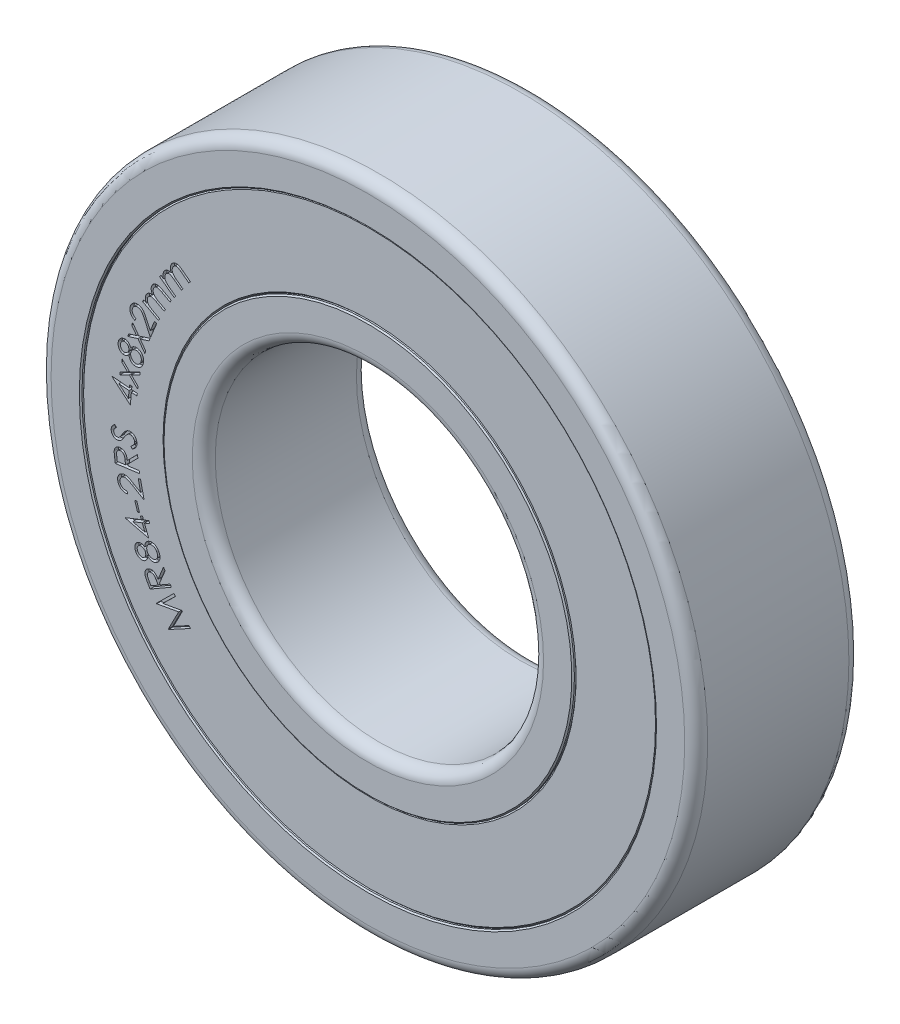
from build123d import *

# Parameters (mm, degrees)
SKETCH_R_INNER_BODY_W          = 2
SKETCH_R_INNER_BODY_H          = 0.5
FILLET_INNER_BODY_R            = 0.14
CHAMFER_INNER_BODY_SIZE        = 0.016
SKETCH_R_OUTER_BODY_W          = 2
SKETCH_R_OUTER_BODY_H          = 0.5
FILLET_OUTER_BODY_R            = 0.14
CHAMFER_OUTER_BODY_SIZE        = 0.016
SKETCH_R_SEAL_FACES_W          = 1.96
SKETCH_R_SEAL_FACES_H          = 1
CHAMFER_SEALS_SIZE             = 0.016
CUT_EXTRUDE_SEAL_LABEL_1_DEPTH = 0.05
CUT_EXTRUDE_SEAL_LABEL_2_DEPTH = 0.05


with BuildPart() as part:
    # Sketch R, INNER BODY → Revolve INNER BODY (revolve)
    with BuildSketch(Plane(origin=(0, 0, 0), x_dir=(0, 0, -1), z_dir=(1, 0, 0)), mode=Mode.PRIVATE) as revolve_inner_body_sk:
        with Locations((0, 2.25)):
            Rectangle(SKETCH_R_INNER_BODY_W, SKETCH_R_INNER_BODY_H)
    revolve(revolve_inner_body_sk.sketch.rotate(Axis((0, 0, 17.5), (0, 0, -1)), 90), axis=Axis((0, 0, 17.5), (0, 0, -1)))

    # Fillet INNER BODY
    fillet_inner_body_edges = [part.edges().sort_by_distance(p)[0] for p in [
        (-2, 0, -1),
        (-2, 0, 1),
    ]]
    fillet(fillet_inner_body_edges, radius=FILLET_INNER_BODY_R)

    # Chamfer INNER BODY
    chamfer_inner_body_edges = [part.edges().sort_by_distance(p)[0] for p in [
        (-2.5, 0, 1),
        (-2.5, 0, -1),
    ]]
    chamfer(chamfer_inner_body_edges, length=CHAMFER_INNER_BODY_SIZE)


with BuildPart() as body_2:
    # Sketch R, OUTER BODY → Revolve OUTER BODY (revolve)
    with BuildSketch(Plane(origin=(0, 0, 0), x_dir=(0, 0, -1), z_dir=(1, 0, 0)), mode=Mode.PRIVATE) as revolve_outer_body_sk:
        with Locations((0, 3.75)):
            Rectangle(SKETCH_R_OUTER_BODY_W, SKETCH_R_OUTER_BODY_H)
    revolve(revolve_outer_body_sk.sketch.rotate(Axis((0, 0, 17.5), (0, 0, -1)), 90), axis=Axis((0, 0, 17.5), (0, 0, -1)))

    # Fillet OUTER BODY
    fillet_outer_body_edges = [body_2.edges().sort_by_distance(p)[0] for p in [
        (-4, 0, 1),
        (-4, 0, -1),
    ]]
    fillet(fillet_outer_body_edges, radius=FILLET_OUTER_BODY_R)

    # Chamfer OUTER BODY
    chamfer_outer_body_edges = [body_2.edges().sort_by_distance(p)[0] for p in [
        (-3.5, 0, -1),
        (-3.5, 0, 1),
    ]]
    chamfer(chamfer_outer_body_edges, length=CHAMFER_OUTER_BODY_SIZE)


with BuildPart() as body_3:
    # Sketch R, SEAL FACES → Revolve SEALS (revolve)
    with BuildSketch(Plane(origin=(0, 0, 0), x_dir=(0, 0, -1), z_dir=(1, 0, 0)), mode=Mode.PRIVATE) as revolve_seals_sk:
        with Locations((0, 3)):
            Rectangle(SKETCH_R_SEAL_FACES_W, SKETCH_R_SEAL_FACES_H)
    revolve(revolve_seals_sk.sketch.rotate(Axis((0, 0, 17.5), (0, 0, -1)), 270), axis=Axis((0, 0, 17.5), (0, 0, -1)))

    # Chamfer SEALS
    chamfer_seals_edges = [body_3.edges().sort_by_distance(p)[0] for p in [
        (2.5, 0, -0.98),
        (2.5, 0, 0.98),
        (3.5, 0, 0.98),
        (3.5, 0, -0.98),
    ]]
    chamfer(chamfer_seals_edges, length=CHAMFER_SEALS_SIZE)

    # Sketch TEXT RADIUS 1 — MANUALLY ASSIGN TEXT AND FONT SIZE (FROM EQUATIONS) → Cut-Extrude SEAL LABEL 1 (cut)
    # profile 1 of 15: a face of its own
    with BuildSketch(Plane.XY.offset(0.98)):
        with BuildLine():
            Line((-2.558636486, 1.694930618), (-2.541749467, 1.717646964))
            Line((-2.541749467, 1.717646964), (-2.511040332, 1.694810426))
            add(Edge.make_bspline(
                [(-2.511040332, 1.694810426), (-2.512280991, 1.698756675), (-2.514656135, 1.706311462), (-2.516829259, 1.717511324), (-2.51809876, 1.7279181), (-2.51779567, 1.734591736), (-2.517650909, 1.737779176)],
                knots=[0, 0, 0, 0, 1.133711147, 2.170401821, 3.126153385, 4, 4, 4, 4], degree=3))
            add(Edge.make_bspline(
                [(-2.517650909, 1.737779176), (-2.517127132, 1.741849795), (-2.516095336, 1.749868566), (-2.512535164, 1.761362177), (-2.507748244, 1.772226935), (-2.503294419, 1.778705837), (-2.501064371, 1.781949849)],
                knots=[0, 0, 0, 0, 1.029592334, 2.028208519, 3.012716142, 4, 4, 4, 4], degree=3))
            add(Edge.make_bspline(
                [(-2.501064371, 1.781949849), (-2.49942459, 1.784030582), (-2.496161406, 1.788171269), (-2.490530726, 1.793686438), (-2.484439081, 1.798590676), (-2.477899154, 1.802779944), (-2.471084161, 1.806234583), (-2.464181836, 1.808989026), (-2.45721379, 1.81079765), (-2.450117497, 1.811793239), (-2.442646907, 1.81191464), (-2.434580797, 1.81098142), (-2.425811642, 1.809248784), (-2.41982102, 1.807462809), (-2.416689371, 1.806529176)],
                knots=[0, 0, 0, 0, 1.006133947, 2.002219767, 2.988037443, 3.974413681, 4.948338274, 5.888642968, 6.7935999, 7.677686355, 8.606763684, 9.625069338, 10.758484874, 12, 12, 12, 12], degree=3))
            add(Edge.make_bspline(
                [(-2.416689371, 1.806529176), (-2.418558573, 1.810957774), (-2.422196186, 1.819576172), (-2.42575461, 1.832843853), (-2.427568153, 1.84587233), (-2.427489165, 1.85861305), (-2.425777599, 1.870917213), (-2.4223524, 1.882609114), (-2.417475374, 1.893718977), (-2.412913696, 1.900363282), (-2.410619659, 1.903704657)],
                knots=[0, 0, 0, 0, 1.126134442, 2.191545574, 3.210634196, 4.201798471, 5.169703975, 6.113696056, 7.051390995, 8, 8, 8, 8], degree=3))
            add(Edge.make_bspline(
                [(-2.410619659, 1.903704657), (-2.408303558, 1.906630595), (-2.403763099, 1.912366573), (-2.395570256, 1.919446098), (-2.386761518, 1.9253015), (-2.377191319, 1.929594961), (-2.367132031, 1.932464729), (-2.356723907, 1.933652346), (-2.346088853, 1.933287513), (-2.337095651, 1.931591549), (-2.329669513, 1.929400643), (-2.323702805, 1.927040584), (-2.317321441, 1.924263693), (-2.310647327, 1.92070124), (-2.303562569, 1.916628477), (-2.296122878, 1.911940038), (-2.2883495, 1.906614824), (-2.283105965, 1.902796734), (-2.280391294, 1.900820041)],
                knots=[0, 0, 0, 0, 1.205806868, 2.36385047, 3.488165439, 4.620217361, 5.745429927, 6.862067355, 7.99775503, 9.178283521, 9.81442438, 10.502197954, 11.254246989, 12.066531209, 12.949843551, 13.899968262, 14.91277629, 16, 16, 16, 16], degree=3))
            Line((-2.280391294, 1.900820041), (-2.183336005, 1.828704657))
            Line((-2.183336005, 1.828704657), (-2.200703794, 1.805327253))
            Line((-2.200703794, 1.805327253), (-2.297759082, 1.877442637))
            add(Edge.make_bspline(
                [(-2.297759082, 1.877442637), (-2.30005342, 1.879138341), (-2.304466108, 1.882399679), (-2.310944489, 1.886870644), (-2.316910346, 1.89087455), (-2.32241299, 1.894336962), (-2.327538022, 1.897106256), (-2.332088242, 1.899540355), (-2.336255278, 1.901259482), (-2.341084816, 1.902974983), (-2.346934871, 1.90412902), (-2.353910939, 1.904362074), (-2.360915144, 1.903520609), (-2.367831032, 1.901492077), (-2.374568021, 1.898481592), (-2.380826781, 1.89419526), (-2.38673272, 1.888988581), (-2.390049504, 1.88477203), (-2.391749467, 1.882610907)],
                knots=[0, 0, 0, 0, 1.262919885, 2.428966884, 3.484123035, 4.443888658, 5.305237461, 6.062773488, 6.726520641, 7.298634089, 8.329969087, 9.350418574, 10.377780713, 11.43877153, 12.530125814, 13.629557002, 14.785068798, 16, 16, 16, 16], degree=3))
            add(Edge.make_bspline(
                [(-2.391749467, 1.882610907), (-2.393670178, 1.879782044), (-2.397459359, 1.874201262), (-2.401425095, 1.86486609), (-2.404008479, 1.855050849), (-2.404907843, 1.844803185), (-2.404391821, 1.834478717), (-2.402323888, 1.824328277), (-2.39872101, 1.814496316), (-2.394465832, 1.806572708), (-2.390130674, 1.800193022), (-2.385832477, 1.795190122), (-2.380862746, 1.789756715), (-2.375004668, 1.784083964), (-2.368360632, 1.77804014), (-2.360878061, 1.771713818), (-2.352540642, 1.7650876), (-2.346666949, 1.760643257), (-2.343612448, 1.75833206)],
                knots=[0, 0, 0, 0, 1.084495062, 2.139492951, 3.204965766, 4.29839391, 5.394931441, 6.47994962, 7.57759551, 8.711209516, 9.329285692, 10.025421986, 10.804870896, 11.669263647, 12.615713179, 13.659141001, 14.782680952, 16, 16, 16, 16], degree=3))
            Line((-2.343612448, 1.75833206), (-2.274021102, 1.706649368))
            Line((-2.274021102, 1.706649368), (-2.290908121, 1.683933022))
            Line((-2.290908121, 1.683933022), (-2.381893698, 1.751541195))
            add(Edge.make_bspline(
                [(-2.381893698, 1.751541195), (-2.384472084, 1.753432017), (-2.389439153, 1.757074545), (-2.396652986, 1.762172745), (-2.403365274, 1.766599235), (-2.409407078, 1.770579135), (-2.414995248, 1.773789615), (-2.419987869, 1.776473988), (-2.424434384, 1.778545332), (-2.429581188, 1.780467905), (-2.435716033, 1.781877866), (-2.443014672, 1.782459243), (-2.450328539, 1.781775933), (-2.457508267, 1.779882971), (-2.46447149, 1.776977144), (-2.470889693, 1.772779514), (-2.476890178, 1.767593173), (-2.480235714, 1.763380215), (-2.481953794, 1.761216676)],
                knots=[0, 0, 0, 0, 1.330001016, 2.56214795, 3.673754839, 4.674562896, 5.570650867, 6.353422693, 7.032001181, 7.60935718, 8.636121873, 9.638835936, 10.642933912, 11.675665768, 12.71726761, 13.766639486, 14.853070837, 16, 16, 16, 16], degree=3))
            add(Edge.make_bspline(
                [(-2.481953794, 1.761216676), (-2.483765222, 1.758523373), (-2.487382357, 1.753145272), (-2.491228754, 1.744133921), (-2.493619286, 1.734496593), (-2.49470881, 1.724423239), (-2.494289805, 1.714153782), (-2.492342405, 1.704033158), (-2.488914661, 1.694185392), (-2.484870808, 1.686221679), (-2.48064743, 1.679958126), (-2.476754132, 1.675032502), (-2.472271443, 1.669849379), (-2.466975972, 1.664571378), (-2.461047031, 1.659053887), (-2.454398167, 1.653362839), (-2.44716024, 1.647379184), (-2.441967514, 1.643505734), (-2.439285525, 1.641505137)],
                knots=[0, 0, 0, 0, 1.084281346, 2.165138473, 3.257655847, 4.396902608, 5.544108325, 6.683907123, 7.832874009, 9.023044461, 9.660729028, 10.357989823, 11.122888282, 11.952379434, 12.858302787, 13.832574235, 14.880546976, 16, 16, 16, 16], degree=3))
            Line((-2.439285525, 1.641505137), (-2.363985044, 1.585555618))
            Line((-2.363985044, 1.585555618), (-2.380872063, 1.562839272))
            Line((-2.380872063, 1.562839272), (-2.558636486, 1.694930618))
        make_face()
    # profile 2 of 15: a face of its own
    with BuildSketch(Plane.XY.offset(0.98)):
        with BuildLine():
            Line((-2.765613018, 1.32865058), (-2.752391864, 1.353470292))
            Line((-2.752391864, 1.353470292), (-2.71885821, 1.335561638))
            add(Edge.make_bspline(
                [(-2.71885821, 1.335561638), (-2.720648467, 1.339258511), (-2.724074832, 1.346333942), (-2.727938167, 1.356975983), (-2.730582412, 1.367019984), (-2.731310829, 1.373589954), (-2.731658691, 1.376727503)],
                knots=[0, 0, 0, 0, 1.135599061, 2.173419002, 3.127699533, 4, 4, 4, 4], degree=3))
            add(Edge.make_bspline(
                [(-2.731658691, 1.376727503), (-2.731735242, 1.380820396), (-2.731886085, 1.38888541), (-2.73009758, 1.400720899), (-2.727000449, 1.412110326), (-2.723580622, 1.419120243), (-2.721863018, 1.422640965)],
                knots=[0, 0, 0, 0, 1.032236312, 2.034013477, 3.01258579, 4, 4, 4, 4], degree=3))
            add(Edge.make_bspline(
                [(-2.721863018, 1.422640965), (-2.720548855, 1.42493546), (-2.717939289, 1.429491697), (-2.713207623, 1.435732486), (-2.707947546, 1.441445867), (-2.702134864, 1.446499772), (-2.696004512, 1.450954291), (-2.689593812, 1.454555277), (-2.683081014, 1.457455332), (-2.676223622, 1.459413896), (-2.668878187, 1.460527809), (-2.660803881, 1.460966505), (-2.651917807, 1.460407136), (-2.645756096, 1.459561332), (-2.642536095, 1.45911933)],
                knots=[0, 0, 0, 0, 1.010591529, 2.006757627, 2.988226482, 3.976521836, 4.948371162, 5.881726074, 6.784280911, 7.66949373, 8.600486472, 9.621051613, 10.756804018, 12, 12, 12, 12], degree=3))
            add(Edge.make_bspline(
                [(-2.642536095, 1.45911933), (-2.645052802, 1.463186029), (-2.649948126, 1.471096289), (-2.655244368, 1.483684066), (-2.659062013, 1.496193305), (-2.660838404, 1.508757484), (-2.660905098, 1.521110354), (-2.659340428, 1.533122956), (-2.656144942, 1.544751107), (-2.652647263, 1.551953836), (-2.65088946, 1.555573657)],
                knots=[0, 0, 0, 0, 1.126269835, 2.190741932, 3.210233924, 4.203041084, 5.171519013, 6.114945955, 7.052642415, 8, 8, 8, 8], degree=3))
            add(Edge.make_bspline(
                [(-2.65088946, 1.555573657), (-2.649040345, 1.558781987), (-2.645413136, 1.565075418), (-2.638459999, 1.57328356), (-2.63060558, 1.580248365), (-2.621873894, 1.585898711), (-2.612411641, 1.590218791), (-2.602354107, 1.592904983), (-2.591849182, 1.594126692), (-2.582774479, 1.593823536), (-2.575155698, 1.592676278), (-2.568897634, 1.591373421), (-2.562228072, 1.589410483), (-2.55513174, 1.58690565), (-2.547541889, 1.583996049), (-2.539584215, 1.580394932), (-2.531116966, 1.57638857), (-2.525416901, 1.573365646), (-2.52246398, 1.571799619)],
                knots=[0, 0, 0, 0, 1.20422392, 2.362195233, 3.485544481, 4.613130943, 5.737484188, 6.859771634, 7.989678021, 9.171398438, 9.804449349, 10.498093775, 11.251895224, 12.06703027, 12.949195903, 13.898615317, 14.911376541, 16, 16, 16, 16], degree=3))
            Line((-2.52246398, 1.571799619), (-2.41651446, 1.515249138))
            Line((-2.41651446, 1.515249138), (-2.430156287, 1.489768369))
            Line((-2.430156287, 1.489768369), (-2.536105807, 1.546318849))
            add(Edge.make_bspline(
                [(-2.536105807, 1.546318849), (-2.538622524, 1.547655107), (-2.543426094, 1.550205575), (-2.550450511, 1.553651786), (-2.556917671, 1.556621187), (-2.56280122, 1.559283862), (-2.568225793, 1.561291869), (-2.573079944, 1.562951273), (-2.57741305, 1.564124206), (-2.582441604, 1.565000964), (-2.588347552, 1.565329638), (-2.595246067, 1.564519515), (-2.60199128, 1.56261996), (-2.608522256, 1.559680419), (-2.614692203, 1.55570404), (-2.620270708, 1.550652908), (-2.625181905, 1.544554899), (-2.627870708, 1.539966774), (-2.629254845, 1.537604907)],
                knots=[0, 0, 0, 0, 1.269428586, 2.422913996, 3.485054143, 4.440153376, 5.298772463, 6.060768355, 6.725336685, 7.29609273, 8.332730508, 9.347862324, 10.376400944, 11.442956249, 12.527212774, 13.633035449, 14.781538476, 16, 16, 16, 16], degree=3))
            add(Edge.make_bspline(
                [(-2.629254845, 1.537604907), (-2.630724838, 1.534561476), (-2.633639289, 1.528527479), (-2.636098922, 1.518762047), (-2.637163592, 1.508739916), (-2.636583936, 1.498546815), (-2.634556808, 1.488461538), (-2.631045912, 1.478781294), (-2.626091232, 1.46962671), (-2.620750194, 1.462475073), (-2.615494694, 1.456888407), (-2.6105935, 1.452560442), (-2.60491786, 1.447935144), (-2.598301666, 1.44326187), (-2.590871352, 1.438305747), (-2.582606567, 1.433153691), (-2.573449964, 1.427874144), (-2.567023526, 1.424388814), (-2.563689941, 1.422580869)],
                knots=[0, 0, 0, 0, 1.079100604, 2.139456862, 3.202715401, 4.29395143, 5.392673652, 6.483589579, 7.576330709, 8.712196021, 9.328895648, 10.027856642, 10.802705228, 11.670812748, 12.618396369, 13.660696371, 14.786533375, 16, 16, 16, 16], degree=3))
            Line((-2.563689941, 1.422580869), (-2.487668307, 1.382015965))
            Line((-2.487668307, 1.382015965), (-2.500949557, 1.357196253))
            Line((-2.500949557, 1.357196253), (-2.600348595, 1.410261157))
            add(Edge.make_bspline(
                [(-2.600348595, 1.410261157), (-2.603166727, 1.411755873), (-2.608557093, 1.414614883), (-2.616399256, 1.418526323), (-2.623581439, 1.421955764), (-2.630142592, 1.424872896), (-2.636089264, 1.427206433), (-2.641393151, 1.429094981), (-2.646055713, 1.430513216), (-2.651396854, 1.431640419), (-2.65763908, 1.432142821), (-2.664900126, 1.431611128), (-2.671997928, 1.429911287), (-2.678753442, 1.426977073), (-2.685189574, 1.423127361), (-2.690844989, 1.417997779), (-2.696009252, 1.412040611), (-2.698679459, 1.407407542), (-2.700048114, 1.405032792)],
                knots=[0, 0, 0, 0, 1.336063675, 2.555549004, 3.670198369, 4.669491475, 5.562261903, 6.345083158, 7.027386475, 7.601678808, 8.62873003, 9.638395486, 10.639624015, 11.669720892, 12.712991594, 13.765131634, 14.854483959, 16, 16, 16, 16], degree=3))
            add(Edge.make_bspline(
                [(-2.700048114, 1.405032792), (-2.701449094, 1.402127001), (-2.704247577, 1.396322627), (-2.706675939, 1.386892565), (-2.707605873, 1.377068114), (-2.707210772, 1.367006063), (-2.705291535, 1.356976486), (-2.701877705, 1.347329618), (-2.697074107, 1.338156106), (-2.69188436, 1.330972877), (-2.686882811, 1.325393373), (-2.68232204, 1.321140143), (-2.677101142, 1.316747185), (-2.67111774, 1.312338164), (-2.664512963, 1.307743206), (-2.65714489, 1.303141922), (-2.649120814, 1.298391676), (-2.643467858, 1.295319089), (-2.640552922, 1.293734715)],
                knots=[0, 0, 0, 0, 1.084632775, 2.166575193, 3.258384601, 4.399805513, 5.54725473, 6.684819176, 7.834825309, 9.02407662, 9.659589305, 10.35651694, 11.122903857, 11.956980453, 12.859220436, 13.832761418, 14.882467366, 16, 16, 16, 16], degree=3))
            Line((-2.640552922, 1.293734715), (-2.558281287, 1.249804426))
            Line((-2.558281287, 1.249804426), (-2.571502441, 1.224984715))
            Line((-2.571502441, 1.224984715), (-2.765613018, 1.32865058))
        make_face()
    # profile 3 of 15: a face of its own
    with BuildSketch(Plane.XY.offset(0.98)):
        with BuildLine():
            Line((-2.845923881, 1.107223774), (-2.856921478, 1.08072137))
            add(Edge.make_bspline(
                [(-2.856921478, 1.08072137), (-2.860196652, 1.082266555), (-2.866627277, 1.085300439), (-2.875606163, 1.090757402), (-2.883827537, 1.096772059), (-2.891258224, 1.103411269), (-2.897891404, 1.110631106), (-2.903719016, 1.118473026), (-2.908755888, 1.126894155), (-2.913024141, 1.135820859), (-2.916343684, 1.145071503), (-2.918814102, 1.154454947), (-2.920173704, 1.163910688), (-2.920601816, 1.17339145), (-2.920073061, 1.182902639), (-2.918460128, 1.192433722), (-2.915959172, 1.202044146), (-2.913553553, 1.208306015), (-2.912330131, 1.211490601)],
                knots=[0, 0, 0, 0, 1.097830309, 2.155529112, 3.181241222, 4.183891268, 5.173028318, 6.15009139, 7.142135589, 8.145024956, 9.146422241, 10.119092125, 11.083241106, 12.038155468, 12.993688248, 13.966642774, 14.965899373, 16, 16, 16, 16], degree=3))
            add(Edge.make_bspline(
                [(-2.912330131, 1.211490601), (-2.910957311, 1.214559344), (-2.908265021, 1.220577573), (-2.903466476, 1.229023113), (-2.897997569, 1.236629526), (-2.892074199, 1.243547181), (-2.885438739, 1.249586234), (-2.878269746, 1.254916474), (-2.870475771, 1.25942225), (-2.862214445, 1.263137763), (-2.853673491, 1.265950286), (-2.84511054, 1.268129758), (-2.836545466, 1.269311076), (-2.828012705, 1.269686869), (-2.8195169, 1.269199699), (-2.811037971, 1.267873643), (-2.802610076, 1.265643938), (-2.797129137, 1.263563043), (-2.794361381, 1.262512236)],
                knots=[0, 0, 0, 0, 1.123881943, 2.204088332, 3.241398016, 4.252881782, 5.243836136, 6.235333802, 7.234968148, 8.248468701, 9.258975874, 10.238725954, 11.199395149, 12.144830918, 13.090931016, 14.040322155, 15.010405229, 16, 16, 16, 16], degree=3))
            add(Edge.make_bspline(
                [(-2.794361381, 1.262512236), (-2.790537429, 1.260796732), (-2.782960974, 1.257397778), (-2.772651476, 1.250423449), (-2.763167262, 1.242424591), (-2.756124607, 1.234569447), (-2.750686292, 1.227488706), (-2.746533707, 1.221184498), (-2.742062742, 1.214128178), (-2.737533298, 1.206144716), (-2.732717729, 1.197384462), (-2.727714357, 1.187762825), (-2.72264514, 1.177224904), (-2.719214605, 1.169907099), (-2.717438305, 1.166118005)],
                knots=[0, 0, 0, 0, 1.190058907, 2.357882056, 3.525913677, 4.711750444, 5.349919985, 6.064205346, 6.857805245, 7.725655373, 8.674218012, 9.701214389, 10.809709242, 12, 12, 12, 12], degree=3))
            Line((-2.717438305, 1.166118005), (-2.671765228, 1.066718967))
            Line((-2.671765228, 1.066718967), (-2.618880612, 1.194243005))
            Line((-2.618880612, 1.194243005), (-2.59219792, 1.183185313))
            Line((-2.59219792, 1.183185313), (-2.669962343, 0.99556512))
            Line((-2.669962343, 0.99556512), (-2.740214747, 1.148329544))
            add(Edge.make_bspline(
                [(-2.740214747, 1.148329544), (-2.741929746, 1.152039137), (-2.745227753, 1.159172824), (-2.750093135, 1.169370707), (-2.754622268, 1.178667254), (-2.759038649, 1.186947357), (-2.76311555, 1.194345975), (-2.76687149, 1.200849593), (-2.770397984, 1.206401408), (-2.774784565, 1.212460093), (-2.780360521, 1.219031044), (-2.787822495, 1.225692119), (-2.795997154, 1.231274133), (-2.801949901, 1.234026916), (-2.804938305, 1.23540887)],
                knots=[0, 0, 0, 0, 1.322616911, 2.543441605, 3.656787029, 4.668907736, 5.580067111, 6.39065289, 7.099203527, 7.707399901, 8.81069602, 9.880474019, 10.935953787, 12, 12, 12, 12], degree=3))
            add(Edge.make_bspline(
                [(-2.804938305, 1.23540887), (-2.806868363, 1.236149153), (-2.81069137, 1.237615486), (-2.816595261, 1.23910814), (-2.822517381, 1.239968782), (-2.828442967, 1.240135131), (-2.834379691, 1.239703976), (-2.840348835, 1.238697343), (-2.846329325, 1.236964324), (-2.852270154, 1.234718642), (-2.858018377, 1.231922627), (-2.86337873, 1.228574963), (-2.868403688, 1.224881041), (-2.872932743, 1.220622454), (-2.877044674, 1.215914438), (-2.880695062, 1.210721618), (-2.883992889, 1.205108094), (-2.88576659, 1.20109342), (-2.886669074, 1.199050697)],
                knots=[0, 0, 0, 0, 0.996690352, 1.974216797, 2.931025163, 3.878660828, 4.828266017, 5.799128031, 6.793519426, 7.827472552, 8.860567007, 9.87177303, 10.873092108, 11.864661194, 12.864813424, 13.883887441, 14.923292305, 16, 16, 16, 16], degree=3))
            add(Edge.make_bspline(
                [(-2.886669074, 1.199050697), (-2.887510956, 1.196860817), (-2.889157167, 1.192578744), (-2.890902395, 1.186016778), (-2.892022666, 1.179520018), (-2.892347733, 1.173030928), (-2.892132735, 1.166610499), (-2.891232867, 1.160215837), (-2.889560348, 1.153917049), (-2.88738206, 1.147642034), (-2.884413821, 1.141598949), (-2.880838747, 1.135779814), (-2.876642802, 1.13023326), (-2.871701108, 1.125071118), (-2.866231999, 1.120102536), (-2.860042174, 1.115494212), (-2.853286532, 1.111079126), (-2.848410861, 1.108526047), (-2.845923881, 1.107223774)],
                knots=[0, 0, 0, 0, 1.006291302, 1.967693882, 2.909012833, 3.830371944, 4.750928478, 5.66281269, 6.59489932, 7.543921149, 8.509045276, 9.477800361, 10.471675137, 11.487361156, 12.540489824, 13.63923357, 14.79582169, 16, 16, 16, 16], degree=3))
        make_face()
    # profile 4 of 15: a face of its own
    with BuildSketch(Plane.XY.offset(0.98)):
        Polygon((-2.945474808, 0.86971263), (-2.934777693, 0.902224649), (-2.838563751, 0.932332822), (-2.898179135, 1.013642918), (-2.88748202, 1.046154938), (-2.811159904, 0.941287149), (-2.674020481, 0.986058784), (-2.684837789, 0.953186188), (-2.794453174, 0.917849649), (-2.726905097, 0.825301572), (-2.737542116, 0.792969842), (-2.821736828, 0.909015515), align=None)
    # profile 5 of 15: a face of its own
    with BuildSketch(Plane.XY.offset(0.98)):
        with BuildLine():
            add(Edge.make_bspline(
                [(-2.91190532, 0.766244059), (-2.910082065, 0.768305541), (-2.906522418, 0.772330291), (-2.900979363, 0.777919691), (-2.895476475, 0.782969573), (-2.889956261, 0.787463153), (-2.884468356, 0.791412479), (-2.878974227, 0.794844947), (-2.87342347, 0.79756917), (-2.866160703, 0.800653608), (-2.856823355, 0.803233391), (-2.845362625, 0.804646977), (-2.833627881, 0.804249739), (-2.825930138, 0.802601891), (-2.822001474, 0.801760886)],
                knots=[0, 0, 0, 0, 0.965883976, 1.885751111, 2.761758735, 3.586511721, 4.382682144, 5.134024769, 5.857302113, 6.550738829, 7.902020236, 9.240821251, 10.591809896, 12, 12, 12, 12], degree=3))
            add(Edge.make_bspline(
                [(-2.822001474, 0.801760886), (-2.819261276, 0.800987744), (-2.813845123, 0.799459584), (-2.806073508, 0.79635014), (-2.798688438, 0.792695865), (-2.791769368, 0.788334283), (-2.785227373, 0.783395931), (-2.779165693, 0.777769348), (-2.773467702, 0.771577615), (-2.770098975, 0.767037297), (-2.768395705, 0.764741656)],
                knots=[0, 0, 0, 0, 1.025790468, 2.027531509, 3.012551851, 3.992369958, 4.971629044, 5.963113795, 6.970125077, 8, 8, 8, 8], degree=3))
            add(Edge.make_bspline(
                [(-2.768395705, 0.764741656), (-2.766481096, 0.761798699), (-2.762683356, 0.75596117), (-2.758258663, 0.746471227), (-2.755117797, 0.736498187), (-2.752932437, 0.72609408), (-2.75218428, 0.715194086), (-2.752400511, 0.703863667), (-2.753872816, 0.692049499), (-2.755684268, 0.684138828), (-2.756616858, 0.680066175)],
                knots=[0, 0, 0, 0, 0.953185673, 1.890700614, 2.834028362, 3.78944945, 4.772188415, 5.79574569, 6.865182921, 8, 8, 8, 8], degree=3))
            add(Edge.make_bspline(
                [(-2.756616858, 0.680066175), (-2.75770217, 0.676202317), (-2.759813045, 0.668687313), (-2.763832372, 0.658005927), (-2.768570077, 0.648265203), (-2.77406451, 0.639527223), (-2.780162617, 0.631669777), (-2.786981339, 0.624788614), (-2.794480099, 0.618842385), (-2.802602228, 0.613950437), (-2.811034669, 0.610013407), (-2.819466753, 0.606703961), (-2.827898802, 0.604291939), (-2.836310807, 0.602724854), (-2.844699382, 0.601916226), (-2.853074232, 0.601985596), (-2.861431888, 0.602872779), (-2.866902741, 0.604091753), (-2.869657724, 0.604705598)],
                knots=[0, 0, 0, 0, 1.265692064, 2.461705755, 3.595037384, 4.676879185, 5.712242853, 6.726622575, 7.725429862, 8.723617201, 9.710153909, 10.658421931, 11.578560883, 12.472211806, 13.354461274, 14.232900102, 15.11013333, 16, 16, 16, 16], degree=3))
            add(Edge.make_bspline(
                [(-2.869657724, 0.604705598), (-2.871650818, 0.605255504), (-2.875581835, 0.606340096), (-2.881268648, 0.608496375), (-2.886730462, 0.610923506), (-2.891917569, 0.613783563), (-2.896882615, 0.616939497), (-2.901484255, 0.620615652), (-2.9059851, 0.624478683), (-2.910123319, 0.628861729), (-2.914086912, 0.633613219), (-2.917658975, 0.638945101), (-2.921043541, 0.644709652), (-2.92410023, 0.651011831), (-2.926926332, 0.657788209), (-2.929431283, 0.665105413), (-2.931735167, 0.672897605), (-2.932968845, 0.678315732), (-2.933600032, 0.681087809)],
                knots=[0, 0, 0, 0, 0.938708474, 1.851432926, 2.759655683, 3.651456356, 4.53990823, 5.428173689, 6.324419964, 7.231867456, 8.162781273, 9.131956311, 10.143274347, 11.197289418, 12.310932502, 13.476418951, 14.708859935, 16, 16, 16, 16], degree=3))
            add(Edge.make_bspline(
                [(-2.933600032, 0.681087809), (-2.936342931, 0.678199638), (-2.941657815, 0.672603263), (-2.950417787, 0.665489554), (-2.959579204, 0.659967973), (-2.968974873, 0.655896864), (-2.978541781, 0.653336732), (-2.988113597, 0.652290926), (-2.997671152, 0.652415115), (-3.003865905, 0.653739765), (-3.006977435, 0.654405117)],
                knots=[0, 0, 0, 0, 1.161003681, 2.249662648, 3.279797315, 4.271825891, 5.227088449, 6.156261844, 7.073918215, 8, 8, 8, 8], degree=3))
            add(Edge.make_bspline(
                [(-3.006977435, 0.654405117), (-3.010101655, 0.655346986), (-3.016363664, 0.657234814), (-3.025174036, 0.661938827), (-3.033570825, 0.667828872), (-3.041333262, 0.67510793), (-3.04826258, 0.683437097), (-3.054065595, 0.692743721), (-3.0584803, 0.702928269), (-3.061755146, 0.713793026), (-3.063544076, 0.725132967), (-3.064134704, 0.736664001), (-3.063235295, 0.748276461), (-3.061592956, 0.755902265), (-3.060763493, 0.759753675)],
                knots=[0, 0, 0, 0, 0.894870432, 1.793627582, 2.72996081, 3.707719042, 4.708684065, 5.700187008, 6.710855444, 7.750746675, 8.81061599, 9.857826602, 10.918096213, 12, 12, 12, 12], degree=3))
            add(Edge.make_bspline(
                [(-3.060763493, 0.759753675), (-3.059693786, 0.763432181), (-3.057576649, 0.770712584), (-3.052810046, 0.780985136), (-3.046870736, 0.790508768), (-3.039802002, 0.799190109), (-3.03180551, 0.806840347), (-3.023057027, 0.813317422), (-3.013604325, 0.818451044), (-3.00361816, 0.822279059), (-2.993349249, 0.824734389), (-2.983088781, 0.825867399), (-2.972910249, 0.825480182), (-2.966338501, 0.824091167), (-2.963047147, 0.823395502)],
                knots=[0, 0, 0, 0, 1.064987439, 2.107795039, 3.139650253, 4.181936081, 5.215100881, 6.21200722, 7.20248522, 8.199594213, 9.17999408, 10.13309587, 11.064991151, 12, 12, 12, 12], degree=3))
            add(Edge.make_bspline(
                [(-2.963047147, 0.823395502), (-2.959864634, 0.822473874), (-2.953621355, 0.820665876), (-2.945003215, 0.816271763), (-2.93721634, 0.810846642), (-2.930358905, 0.804183885), (-2.924352983, 0.796393065), (-2.919252097, 0.787425692), (-2.915020017, 0.777280323), (-2.912969717, 0.770015524), (-2.91190532, 0.766244059)],
                knots=[0, 0, 0, 0, 0.980860424, 1.924198381, 2.853946148, 3.786840407, 4.748342531, 5.762456456, 6.838396434, 8, 8, 8, 8], degree=3))
        make_face()
        with BuildLine():
            add(Edge.make_bspline(
                [(-3.032938974, 0.751159925), (-3.033389876, 0.74920283), (-3.034276615, 0.745354028), (-3.035065769, 0.739584245), (-3.035296281, 0.733952822), (-3.03508243, 0.728457627), (-3.034288133, 0.723106019), (-3.033011103, 0.71789966), (-3.031290882, 0.712826386), (-3.028982597, 0.708011669), (-3.02638199, 0.703432305), (-3.023350022, 0.69930441), (-3.020120269, 0.695536732), (-3.016553269, 0.6922616), (-3.012647288, 0.68949381), (-3.008509776, 0.687064506), (-3.004032214, 0.685112953), (-3.000879998, 0.684235889), (-2.999285128, 0.683792136)],
                knots=[0, 0, 0, 0, 1.149472168, 2.260540139, 3.328138192, 4.372820007, 5.404387743, 6.419697157, 7.438885761, 8.46501995, 9.472199734, 10.449485803, 11.392453548, 12.309754122, 13.213693307, 14.128409122, 15.05306507, 16, 16, 16, 16], degree=3))
            add(Edge.make_bspline(
                [(-2.999285128, 0.683792136), (-2.997669289, 0.683426777), (-2.994463897, 0.682702001), (-2.989553582, 0.682410038), (-2.984636629, 0.682480731), (-2.979720163, 0.68323212), (-2.974763011, 0.68451195), (-2.969829483, 0.686389031), (-2.96482996, 0.688754136), (-2.959933022, 0.691666101), (-2.955222607, 0.694993497), (-2.95087732, 0.698671939), (-2.946953003, 0.702635575), (-2.943499889, 0.706920136), (-2.940560492, 0.71154532), (-2.937950999, 0.716402478), (-2.935821996, 0.721597002), (-2.934825122, 0.725226564), (-2.934321185, 0.727061367)],
                knots=[0, 0, 0, 0, 0.922555664, 1.830102767, 2.735446079, 3.661446269, 4.596436312, 5.586426205, 6.601017806, 7.677988261, 8.759989831, 9.814408033, 10.849466503, 11.866823082, 12.877222137, 13.901915517, 14.939383625, 16, 16, 16, 16], degree=3))
            add(Edge.make_bspline(
                [(-2.934321185, 0.727061367), (-2.933800218, 0.729455276), (-2.932762207, 0.734225068), (-2.932281696, 0.741549442), (-2.932864738, 0.748876267), (-2.934292463, 0.756124596), (-2.936601482, 0.763130446), (-2.93984655, 0.769666222), (-2.94378663, 0.775768844), (-2.948701476, 0.7810741), (-2.953944031, 0.785824481), (-2.959625588, 0.789644844), (-2.965505568, 0.792664833), (-2.969655038, 0.793927012), (-2.971700993, 0.794549348)],
                knots=[0, 0, 0, 0, 1.032439809, 2.057104798, 3.082361907, 4.124712705, 5.166823729, 6.183373539, 7.195806109, 8.218936958, 9.224505499, 10.1736769, 11.099505228, 12, 12, 12, 12], degree=3))
            add(Edge.make_bspline(
                [(-2.971700993, 0.794549348), (-2.974633778, 0.795121548), (-2.98049217, 0.796264549), (-2.989655853, 0.795606289), (-2.998807404, 0.79303669), (-3.006332798, 0.789529415), (-3.012140775, 0.785820186), (-3.016210463, 0.782381748), (-3.019966156, 0.778488546), (-3.023247183, 0.773972034), (-3.026285775, 0.769029613), (-3.028917523, 0.763552069), (-3.03114328, 0.757544049), (-3.032327835, 0.753332671), (-3.032938974, 0.751159925)],
                knots=[0, 0, 0, 0, 1.279381727, 2.555632541, 3.902411256, 5.346431971, 6.105643153, 6.85725345, 7.630437087, 8.424048318, 9.250718827, 10.120749359, 11.03045185, 12, 12, 12, 12], degree=3))
        make_face(mode=Mode.SUBTRACT)
        with BuildLine():
            add(Edge.make_bspline(
                [(-2.907938974, 0.720751271), (-2.908502155, 0.718275393), (-2.909607314, 0.713416858), (-2.910515674, 0.706113698), (-2.91069443, 0.698968983), (-2.910210333, 0.691967788), (-2.909093662, 0.685090842), (-2.907182245, 0.678382577), (-2.904680487, 0.671797896), (-2.901415107, 0.665503008), (-2.897735758, 0.659507315), (-2.893607146, 0.654053831), (-2.889110624, 0.649191284), (-2.884277238, 0.644878827), (-2.879049778, 0.6411653), (-2.873465514, 0.637994269), (-2.867513348, 0.635457436), (-2.863342126, 0.634269435), (-2.861244262, 0.633671944)],
                knots=[0, 0, 0, 0, 1.110036862, 2.178279454, 3.212457095, 4.231191963, 5.243767168, 6.253495549, 7.276928971, 8.319202566, 9.3500719, 10.350636016, 11.305426144, 12.242566884, 13.178560171, 14.10445259, 15.046658109, 16, 16, 16, 16], degree=3))
            add(Edge.make_bspline(
                [(-2.861244262, 0.633671944), (-2.858590969, 0.633118374), (-2.853284674, 0.632011296), (-2.845136072, 0.631661297), (-2.836959447, 0.632566999), (-2.828823123, 0.634457983), (-2.820926432, 0.637482396), (-2.813553595, 0.641707399), (-2.806791358, 0.646981349), (-2.800641533, 0.653260739), (-2.79521347, 0.660519565), (-2.790604592, 0.668694388), (-2.786695081, 0.677686345), (-2.784887195, 0.684107107), (-2.783960608, 0.687397906)],
                knots=[0, 0, 0, 0, 0.926151662, 1.852201906, 2.775484214, 3.732925561, 4.702672762, 5.657215817, 6.629091462, 7.627354433, 8.655284409, 9.720326578, 10.831611381, 12, 12, 12, 12], degree=3))
            add(Edge.make_bspline(
                [(-2.783960608, 0.687397906), (-2.783357844, 0.689993832), (-2.782178784, 0.69507169), (-2.781155124, 0.702652235), (-2.780831653, 0.709996492), (-2.781249576, 0.717063943), (-2.782349975, 0.723884845), (-2.784060786, 0.730451761), (-2.786572563, 0.736739784), (-2.789671154, 0.74272203), (-2.793351766, 0.748276442), (-2.797342336, 0.753391306), (-2.80172741, 0.757943844), (-2.806416074, 0.761995936), (-2.811494654, 0.765500694), (-2.81693567, 0.768452713), (-2.822713568, 0.770882318), (-2.826755476, 0.772033919), (-2.828792339, 0.772614252)],
                knots=[0, 0, 0, 0, 1.188253225, 2.324327179, 3.406445098, 4.462687452, 5.47630536, 6.484156623, 7.483055749, 8.490193769, 9.484004309, 10.451104254, 11.380095255, 12.29888865, 13.211009972, 14.126669625, 15.055961388, 16, 16, 16, 16], degree=3))
            add(Edge.make_bspline(
                [(-2.828792339, 0.772614252), (-2.830807931, 0.773060497), (-2.834789059, 0.773941906), (-2.840881702, 0.774462263), (-2.846945724, 0.774349865), (-2.853010845, 0.773555786), (-2.85904955, 0.772095223), (-2.865072839, 0.769989071), (-2.871064745, 0.767165972), (-2.87699498, 0.763803901), (-2.882645077, 0.759877347), (-2.887855673, 0.75551628), (-2.89258086, 0.750791169), (-2.896661575, 0.745530473), (-2.900382368, 0.739976548), (-2.903398438, 0.733904875), (-2.906054751, 0.727519606), (-2.907304421, 0.723030656), (-2.907938974, 0.720751271)],
                knots=[0, 0, 0, 0, 0.945333368, 1.867189986, 2.794698864, 3.720570318, 4.664788353, 5.637546206, 6.639839997, 7.6966651, 8.758741738, 9.788539375, 10.807846441, 11.814462383, 12.835628557, 13.866285365, 14.916549255, 16, 16, 16, 16], degree=3))
        make_face(mode=Mode.SUBTRACT)
    # profile 6 of 15: a face of its own
    with BuildSketch(Plane.XY.offset(0.98)):
        Polygon((-3.043023221, 0.414642657), (-3.037674663, 0.448416696), (-2.947470336, 0.493428715), (-3.019345336, 0.564161888), (-3.013996779, 0.597935927), (-2.921929471, 0.506709965), (-2.793864567, 0.572695542), (-2.799273221, 0.53850083), (-2.901677067, 0.48615708), (-2.820306875, 0.40568833), (-2.825655433, 0.372154677), (-2.927217933, 0.473116215), align=None)
    # profile 7 of 15: a face of its own
    with BuildSketch(Plane.XY.offset(0.98)):
        Polygon((-3.136145843, 0.348639888), (-3.135604977, 0.3547096), (-2.927672285, 0.335779312), (-2.924366996, 0.3718971), (-2.895761227, 0.369312965), (-2.899066516, 0.333195177), (-2.829715554, 0.326885081), (-2.832419881, 0.297077388), (-2.901770843, 0.303387485), (-2.914751612, 0.160839408), align=None)
        Polygon((-2.930376612, 0.305971619), (-3.054715554, 0.317329792), (-2.9383694, 0.218171138), align=None, mode=Mode.SUBTRACT)
    # profile 8 of 15: a face of its own
    with BuildSketch(Plane.XY.offset(0.98)):
        with BuildLine():
            Line((-2.890856247, -0.292121752), (-2.907923554, -0.267842906))
            add(Edge.make_bspline(
                [(-2.907923554, -0.267842906), (-2.904192973, -0.265340455), (-2.89705696, -0.260553661), (-2.887518005, -0.252711326), (-2.879479871, -0.244776486), (-2.87300564, -0.236629832), (-2.868151493, -0.228276416), (-2.86472545, -0.21982304), (-2.862942771, -0.211126662), (-2.863082159, -0.205309554), (-2.86315192, -0.202398194)],
                knots=[0, 0, 0, 0, 1.293927635, 2.47507894, 3.55271993, 4.543572214, 5.464398836, 6.327347718, 7.162866959, 8, 8, 8, 8], degree=3))
            add(Edge.make_bspline(
                [(-2.86315192, -0.202398194), (-2.863436417, -0.199925297), (-2.863997658, -0.195046903), (-2.865818717, -0.187895356), (-2.868631426, -0.181106295), (-2.872156906, -0.174660077), (-2.8762764, -0.168701803), (-2.881168487, -0.163639926), (-2.886484372, -0.159267075), (-2.892389078, -0.155899441), (-2.898562073, -0.153288267), (-2.904936801, -0.151617103), (-2.911424041, -0.150699023), (-2.915773785, -0.150869978), (-2.917959612, -0.150955887)],
                knots=[0, 0, 0, 0, 1.071260212, 2.113322589, 3.165903219, 4.227636896, 5.273691591, 6.274472341, 7.249981431, 8.228081316, 9.191034376, 10.128569431, 11.059571617, 12, 12, 12, 12], degree=3))
            add(Edge.make_bspline(
                [(-2.917959612, -0.150955887), (-2.920441025, -0.151274113), (-2.9254412, -0.151915356), (-2.932769875, -0.154433828), (-2.939913167, -0.15818389), (-2.944305609, -0.161506252), (-2.946565381, -0.163215502)],
                knots=[0, 0, 0, 0, 0.948287308, 1.910848136, 2.925197277, 4, 4, 4, 4], degree=3))
            add(Edge.make_bspline(
                [(-2.946565381, -0.163215502), (-2.948185601, -0.164598284), (-2.951605703, -0.167517181), (-2.956608153, -0.172511721), (-2.961794394, -0.178271691), (-2.967177928, -0.184769814), (-2.972825031, -0.191972194), (-2.978661586, -0.199925481), (-2.984656455, -0.208634537), (-2.988627151, -0.214748373), (-2.990675958, -0.217903002)],
                knots=[0, 0, 0, 0, 0.724821148, 1.530015821, 2.403774364, 3.362355894, 4.401731017, 5.518661772, 6.719674277, 8, 8, 8, 8], degree=3))
            add(Edge.make_bspline(
                [(-2.990675958, -0.217903002), (-2.992704691, -0.221037679), (-2.996590091, -0.227041167), (-3.002377136, -0.235477073), (-3.007633143, -0.243067278), (-3.012503599, -0.249715485), (-3.017006319, -0.255402057), (-3.021028831, -0.26023184), (-3.024577146, -0.264190995), (-3.026977301, -0.266337533), (-3.028055766, -0.267302041)],
                knots=[0, 0, 0, 0, 1.443060839, 2.763729406, 3.953627258, 5.01126561, 5.948371239, 6.756282633, 7.441158569, 8, 8, 8, 8], degree=3))
            add(Edge.make_bspline(
                [(-3.028055766, -0.267302041), (-3.029716627, -0.268692473), (-3.033001613, -0.271442581), (-3.038250431, -0.275027377), (-3.043606958, -0.278171005), (-3.049106536, -0.280842336), (-3.054761365, -0.282995474), (-3.060540631, -0.28470449), (-3.066483456, -0.28584254), (-3.070499906, -0.28626135), (-3.07252692, -0.286472714)],
                knots=[0, 0, 0, 0, 1.054242867, 2.085166263, 3.09067007, 4.076679224, 5.058578276, 6.034060253, 7.007833641, 8, 8, 8, 8], degree=3))
            add(Edge.make_bspline(
                [(-3.07252692, -0.286472714), (-3.075714167, -0.286600734), (-3.081989294, -0.286852783), (-3.091289939, -0.285705813), (-3.100251774, -0.283432836), (-3.108779888, -0.279909805), (-3.116815527, -0.275402793), (-3.123978754, -0.269635687), (-3.13052835, -0.263049671), (-3.136094903, -0.255417249), (-3.140807416, -0.247129854), (-3.14426304, -0.238224081), (-3.146854435, -0.228930414), (-3.147500416, -0.222486779), (-3.147827401, -0.219225117)],
                knots=[0, 0, 0, 0, 1.018201856, 2.004660142, 2.983084481, 3.965273131, 4.946145916, 5.917187878, 6.89523499, 7.906973289, 8.927588426, 9.933535156, 10.953989585, 12, 12, 12, 12], degree=3))
            add(Edge.make_bspline(
                [(-3.147827401, -0.219225117), (-3.147959315, -0.215757934), (-3.148221742, -0.208860424), (-3.146983408, -0.198574933), (-3.144326438, -0.188587373), (-3.141157549, -0.180427876), (-3.137732947, -0.174039698), (-3.134654, -0.169057906), (-3.130951997, -0.164050836), (-3.126804365, -0.158841297), (-3.122055517, -0.153576849), (-3.116736787, -0.148251011), (-3.110966586, -0.142732629), (-3.106818644, -0.139158343), (-3.104678362, -0.13731406)],
                knots=[0, 0, 0, 0, 1.291933812, 2.57013422, 3.843395508, 5.137140806, 5.821939841, 6.543029989, 7.318230558, 8.141568919, 9.024641453, 9.959251276, 10.947001047, 12, 12, 12, 12], degree=3))
            Line((-3.104678362, -0.13731406), (-3.084425958, -0.160270791))
            add(Edge.make_bspline(
                [(-3.084425958, -0.160270791), (-3.08612268, -0.161757995), (-3.089407192, -0.164636924), (-3.093933659, -0.16905193), (-3.098091392, -0.173150206), (-3.101744303, -0.177098229), (-3.104915233, -0.180881548), (-3.107691293, -0.18443769), (-3.109935149, -0.1878483), (-3.11234719, -0.192055286), (-3.114536933, -0.197388746), (-3.116302584, -0.203929313), (-3.117192208, -0.210688764), (-3.117023496, -0.21523699), (-3.116937978, -0.217542425)],
                knots=[0, 0, 0, 0, 1.182733092, 2.289533418, 3.314415937, 4.243493924, 5.108184606, 5.902249703, 6.607198209, 7.246842332, 8.442561668, 9.617058487, 10.792118704, 12, 12, 12, 12], degree=3))
            add(Edge.make_bspline(
                [(-3.116937978, -0.217542425), (-3.116608184, -0.220429943), (-3.11597202, -0.225999888), (-3.113228138, -0.233779448), (-3.109301043, -0.240669984), (-3.10402506, -0.246433427), (-3.097855315, -0.251007139), (-3.091015787, -0.254204789), (-3.083607308, -0.255904511), (-3.078544446, -0.2558113), (-3.075952401, -0.255763579)],
                knots=[0, 0, 0, 0, 1.111165679, 2.143408961, 3.137936159, 4.132937704, 5.116011919, 6.06436383, 7.00900788, 8, 8, 8, 8], degree=3))
            add(Edge.make_bspline(
                [(-3.075952401, -0.255763579), (-3.074342866, -0.255604521), (-3.07113062, -0.25528708), (-3.066439672, -0.254071975), (-3.061825504, -0.252540051), (-3.057276423, -0.250379775), (-3.052714348, -0.247504108), (-3.048087603, -0.243790173), (-3.043326887, -0.239245255), (-3.040251303, -0.235814371), (-3.038632689, -0.234008771)],
                knots=[0, 0, 0, 0, 0.871855443, 1.740014431, 2.60864475, 3.493877788, 4.451026873, 5.513337343, 6.69132293, 8, 8, 8, 8], degree=3))
            add(Edge.make_bspline(
                [(-3.038632689, -0.234008771), (-3.038109068, -0.233329786), (-3.036858704, -0.231708426), (-3.034768195, -0.228827564), (-3.032163939, -0.225060505), (-3.029071096, -0.220404245), (-3.02547557, -0.214855595), (-3.021302041, -0.208495589), (-3.016690964, -0.201200413), (-3.013432476, -0.196047944), (-3.011709612, -0.193323675)],
                knots=[0, 0, 0, 0, 0.421666592, 1.006904284, 1.750226394, 2.673757406, 3.755819351, 5.001841412, 6.414781038, 8, 8, 8, 8], degree=3))
            add(Edge.make_bspline(
                [(-3.011709612, -0.193323675), (-3.009611069, -0.190021902), (-3.005550974, -0.183633895), (-2.999247647, -0.174623781), (-2.993214325, -0.166303786), (-2.987267636, -0.158778268), (-2.981442274, -0.152050003), (-2.975797577, -0.146063163), (-2.970275379, -0.140861407), (-2.963164061, -0.13512421), (-2.954331351, -0.12912238), (-2.943345454, -0.123821271), (-2.93224651, -0.120045777), (-2.924657251, -0.119174968), (-2.920904324, -0.118744348)],
                knots=[0, 0, 0, 0, 1.154037072, 2.232738851, 3.243388852, 4.185742659, 5.061375228, 5.868169806, 6.612433029, 7.29728515, 8.562665123, 9.752068826, 10.888386321, 12, 12, 12, 12], degree=3))
            add(Edge.make_bspline(
                [(-2.920904324, -0.118744348), (-2.918240326, -0.118635506), (-2.91296685, -0.11842005), (-2.905123913, -0.118951547), (-2.897495021, -0.120360796), (-2.89008059, -0.122525494), (-2.882859575, -0.125491238), (-2.875905119, -0.129312615), (-2.86910321, -0.1338473), (-2.862657986, -0.139155934), (-2.856604009, -0.144985449), (-2.851213984, -0.151319906), (-2.846622716, -0.158088427), (-2.842535673, -0.16513228), (-2.839494211, -0.172696931), (-2.836978043, -0.18055732), (-2.835214548, -0.188832895), (-2.834652023, -0.194518102), (-2.834365862, -0.197410214)],
                knots=[0, 0, 0, 0, 0.98491114, 1.949665135, 2.897915616, 3.846743946, 4.799521121, 5.77680638, 6.774737271, 7.816549576, 8.858440795, 9.877486636, 10.883731483, 11.8782512, 12.880566454, 13.889748455, 14.926497756, 16, 16, 16, 16], degree=3))
            add(Edge.make_bspline(
                [(-2.834365862, -0.197410214), (-2.834225109, -0.199653097), (-2.833946164, -0.204098073), (-2.834242909, -0.210727255), (-2.834897472, -0.217228809), (-2.835945747, -0.223632824), (-2.837600922, -0.229865508), (-2.839653753, -0.235994554), (-2.842163582, -0.241991473), (-2.845209656, -0.247871273), (-2.848749217, -0.253661365), (-2.852952918, -0.259351082), (-2.857764678, -0.26496185), (-2.863133769, -0.270588085), (-2.869143759, -0.276123946), (-2.875863792, -0.281478169), (-2.883062916, -0.286951437), (-2.888211868, -0.290367397), (-2.890856247, -0.292121752)],
                knots=[0, 0, 0, 0, 0.925360742, 1.833892975, 2.729929062, 3.617370338, 4.504235666, 5.383850451, 6.279087847, 7.179825578, 8.109886222, 9.072345262, 10.091162278, 11.153645209, 12.275208027, 13.454711463, 14.692800752, 16, 16, 16, 16], degree=3))
        make_face()
    # profile 9 of 15: a face of its own
    with BuildSketch(Plane.XY.offset(0.98)):
        with BuildLine():
            Line((-3.098184298, -0.545947049), (-3.106056895, -0.487052818))
            add(Edge.make_bspline(
                [(-3.106056895, -0.487052818), (-3.106563379, -0.483107271), (-3.107532073, -0.475561082), (-3.108831615, -0.464728867), (-3.109753718, -0.454864063), (-3.110578935, -0.445976409), (-3.111086355, -0.43803984), (-3.111223732, -0.431085175), (-3.111316409, -0.425107749), (-3.111047458, -0.421467137), (-3.110924683, -0.419805222)],
                knots=[0, 0, 0, 0, 1.41390786, 2.704217313, 3.877456621, 4.935287826, 5.876864661, 6.703071663, 7.407960913, 8, 8, 8, 8], degree=3))
            add(Edge.make_bspline(
                [(-3.110924683, -0.419805222), (-3.110689112, -0.417574433), (-3.110225155, -0.413180903), (-3.10875883, -0.406773415), (-3.107014526, -0.400581573), (-3.104682852, -0.394674886), (-3.102000962, -0.38897118), (-3.098736854, -0.38358671), (-3.095030381, -0.37843095), (-3.090917812, -0.373523164), (-3.086364951, -0.368966184), (-3.081437121, -0.364849213), (-3.076085903, -0.361305987), (-3.070433464, -0.358158322), (-3.064394517, -0.355511208), (-3.058015887, -0.353364774), (-3.051289543, -0.351640102), (-3.046649598, -0.350934895), (-3.044278048, -0.350574453)],
                knots=[0, 0, 0, 0, 1.030886406, 2.030326234, 3.018832625, 3.98733908, 4.947614016, 5.914716837, 6.878742085, 7.86621726, 8.856568562, 9.838136468, 10.814370316, 11.804207105, 12.810883979, 13.842387892, 14.89720994, 16, 16, 16, 16], degree=3))
            add(Edge.make_bspline(
                [(-3.044278048, -0.350574453), (-3.040355483, -0.350184824), (-3.032693528, -0.349423762), (-3.021324006, -0.35014483), (-3.01047289, -0.352255351), (-3.000276907, -0.356053188), (-2.990749703, -0.361127016), (-2.98221827, -0.367786608), (-2.974614612, -0.37575518), (-2.969194537, -0.383485517), (-2.965303442, -0.390370466), (-2.96260589, -0.39616213), (-2.960164804, -0.402500271), (-2.957866829, -0.409349937), (-2.955855118, -0.416764679), (-2.953981752, -0.424696075), (-2.952358767, -0.433177724), (-2.951506743, -0.43903231), (-2.951068914, -0.442040799)],
                knots=[0, 0, 0, 0, 1.272770841, 2.486105917, 3.668745269, 4.834735956, 5.991134011, 7.145498582, 8.318323774, 9.540392887, 10.1871432, 10.873881932, 11.604000669, 12.382346611, 13.208922913, 14.087178428, 15.017060906, 16, 16, 16, 16], degree=3))
            Line((-2.951068914, -0.442040799), (-2.827811702, -0.317401376))
            Line((-2.827811702, -0.317401376), (-2.822943914, -0.353999934))
            Line((-2.822943914, -0.353999934), (-2.946261221, -0.478398972))
            Line((-2.946261221, -0.478398972), (-2.943977568, -0.495285991))
            Line((-2.943977568, -0.495285991), (-2.806537664, -0.476956664))
            Line((-2.806537664, -0.476956664), (-2.802571318, -0.506523972))
            Line((-2.802571318, -0.506523972), (-3.098184298, -0.545947049))
        make_face()
        with BuildLine():
            Line((-3.073184298, -0.512533587), (-2.972703529, -0.499132145))
            Line((-2.972703529, -0.499132145), (-2.979133818, -0.448230703))
            add(Edge.make_bspline(
                [(-2.979133818, -0.448230703), (-2.979459475, -0.445844646), (-2.980087548, -0.441242827), (-2.981238494, -0.434610171), (-2.98248456, -0.428493676), (-2.983858729, -0.422876466), (-2.985382786, -0.417777393), (-2.986882029, -0.413124753), (-2.988662665, -0.409038336), (-2.991016948, -0.40424143), (-2.994480582, -0.398973517), (-2.999432102, -0.393550872), (-3.005058472, -0.388942318), (-3.011466584, -0.385484761), (-3.018247234, -0.382770317), (-3.025394347, -0.381247603), (-3.032762663, -0.380647082), (-3.037689113, -0.381109034), (-3.04019151, -0.381343684)],
                knots=[0, 0, 0, 0, 1.119443569, 2.158992007, 3.128793973, 4.020953071, 4.846046466, 5.602887539, 6.291323211, 6.916027573, 8.086077332, 9.206759738, 10.319365047, 11.449103542, 12.578381357, 13.703620186, 14.833550574, 16, 16, 16, 16], degree=3))
            add(Edge.make_bspline(
                [(-3.04019151, -0.381343684), (-3.042615607, -0.38174445), (-3.047402239, -0.382535805), (-3.054175958, -0.385107222), (-3.060535168, -0.388469434), (-3.066241336, -0.392871013), (-3.071280574, -0.397927869), (-3.075433018, -0.403602588), (-3.078653322, -0.40977748), (-3.080508901, -0.415376929), (-3.081581446, -0.420253236), (-3.081995303, -0.424485439), (-3.082314794, -0.429214743), (-3.082353295, -0.434470403), (-3.082165202, -0.440243187), (-3.081736076, -0.446536119), (-3.081071606, -0.453349569), (-3.080468812, -0.458047911), (-3.080155452, -0.460490318)],
                knots=[0, 0, 0, 0, 1.163548242, 2.297547097, 3.42061163, 4.567294544, 5.703523331, 6.798919016, 7.891836053, 8.995289854, 9.588298846, 10.258187103, 11.010817361, 11.83806287, 12.751270783, 13.751820649, 14.831296515, 16, 16, 16, 16], degree=3))
            Line((-3.080155452, -0.460490318), (-3.073184298, -0.512533587))
        make_face(mode=Mode.SUBTRACT)
    # profile 10 of 15: a face of its own
    with BuildSketch(Plane.XY.offset(0.98)):
        with BuildLine():
            Line((-2.953850844, -0.765613811), (-2.947721036, -0.793438331))
            add(Edge.make_bspline(
                [(-2.947721036, -0.793438331), (-2.951258146, -0.794044238), (-2.958219799, -0.79523677), (-2.968628731, -0.795880471), (-2.978739556, -0.795555373), (-2.988551217, -0.794468028), (-2.998073587, -0.792330526), (-3.00727431, -0.789267044), (-3.016175057, -0.785247687), (-3.024715189, -0.780416601), (-3.032725624, -0.774823683), (-3.039986397, -0.768510776), (-3.046516058, -0.761649675), (-3.052254078, -0.754153747), (-3.057194076, -0.746068833), (-3.06135402, -0.737385401), (-3.064830203, -0.728148203), (-3.066398004, -0.721663251), (-3.06719219, -0.718378235)],
                knots=[0, 0, 0, 0, 1.095270643, 2.155684693, 3.177716172, 4.181572155, 5.165549325, 6.152109116, 7.137815113, 8.14316105, 9.144441652, 10.115826518, 11.076442419, 12.032000407, 12.993005774, 13.964275065, 14.968783175, 16, 16, 16, 16], degree=3))
            add(Edge.make_bspline(
                [(-3.06719219, -0.718378235), (-3.067831661, -0.715102312), (-3.069083998, -0.708686764), (-3.06993605, -0.69908367), (-3.069790442, -0.689788907), (-3.068879539, -0.680776255), (-3.066923548, -0.672077113), (-3.064089415, -0.663674554), (-3.060336295, -0.655577944), (-3.055714531, -0.647864578), (-3.050401891, -0.64067559), (-3.044624814, -0.634064699), (-3.038350832, -0.628219551), (-3.031624327, -0.623077117), (-3.024470895, -0.618582764), (-3.01675998, -0.61494387), (-3.008650618, -0.611883104), (-3.002986487, -0.610488872), (-3.000124882, -0.609784485)],
                knots=[0, 0, 0, 0, 1.123585916, 2.200424695, 3.239468568, 4.250471496, 5.245661463, 6.235577952, 7.231682195, 8.245225533, 9.258589227, 10.238500819, 11.19794742, 12.141151109, 13.086547877, 14.037058115, 15.008291972, 16, 16, 16, 16], degree=3))
            add(Edge.make_bspline(
                [(-3.000124882, -0.609784485), (-2.996031405, -0.609042242), (-2.987930507, -0.607573362), (-2.975572904, -0.607154669), (-2.963322244, -0.608464744), (-2.95311919, -0.61082486), (-2.944666212, -0.613533283), (-2.937675803, -0.616275513), (-2.930043244, -0.619527567), (-2.921769498, -0.623320623), (-2.912893751, -0.627793793), (-2.903367441, -0.632842063), (-2.893191982, -0.638420844), (-2.886273959, -0.642441291), (-2.882696998, -0.644520061)],
                knots=[0, 0, 0, 0, 1.190680869, 2.356330225, 3.527504016, 4.71080479, 5.349633675, 6.069011781, 6.860973758, 7.726320122, 8.675897946, 9.707859946, 10.814849894, 12, 12, 12, 12], degree=3))
            Line((-2.882696998, -0.644520061), (-2.788946998, -0.699568138))
            Line((-2.788946998, -0.699568138), (-2.818394113, -0.565673908))
            Line((-2.818394113, -0.565673908), (-2.790389305, -0.5595441))
            Line((-2.790389305, -0.5595441), (-2.747059979, -0.756539292))
            Line((-2.747059979, -0.756539292), (-2.891110459, -0.6720441))
            add(Edge.make_bspline(
                [(-2.891110459, -0.6720441), (-2.894611543, -0.669993015), (-2.901332745, -0.666055448), (-2.911080766, -0.660511233), (-2.920090173, -0.655570072), (-2.928373998, -0.651261047), (-2.935874333, -0.647481386), (-2.942697627, -0.64443972), (-2.948718715, -0.64186975), (-2.955733037, -0.639406676), (-2.963999065, -0.637194596), (-2.97386767, -0.636110882), (-2.983708841, -0.636108487), (-2.990119594, -0.637308023), (-2.993334017, -0.637909485)],
                knots=[0, 0, 0, 0, 1.321720536, 2.537371688, 3.652857373, 4.668528143, 5.578998885, 6.387966443, 7.101723678, 7.710529167, 8.808878403, 9.879688231, 10.936852024, 12, 12, 12, 12], degree=3))
            add(Edge.make_bspline(
                [(-2.993334017, -0.637909485), (-2.995328422, -0.638412439), (-2.99925411, -0.639402431), (-3.004881079, -0.641523601), (-3.010157215, -0.644188256), (-3.015089027, -0.647401061), (-3.019752796, -0.651064738), (-3.024037747, -0.655304327), (-3.027953675, -0.660097967), (-3.031509167, -0.665327237), (-3.034639596, -0.670854607), (-3.037098599, -0.676634915), (-3.039060774, -0.682510993), (-3.0403064, -0.688564177), (-3.04097603, -0.694722697), (-3.041022665, -0.701000885), (-3.040495185, -0.707422727), (-3.039668791, -0.711693632), (-3.039247479, -0.713871023)],
                knots=[0, 0, 0, 0, 0.999435488, 1.967238885, 2.916786268, 3.86773122, 4.824493923, 5.795575283, 6.791968921, 7.829315047, 8.867072592, 9.874825825, 10.878901287, 11.874104177, 12.873302354, 13.886266317, 14.922377208, 16, 16, 16, 16], degree=3))
            add(Edge.make_bspline(
                [(-3.039247479, -0.713871023), (-3.038686632, -0.716126392), (-3.037585659, -0.720553808), (-3.035267544, -0.726911174), (-3.032474352, -0.732873465), (-3.029067611, -0.738366673), (-3.025211802, -0.743446875), (-3.020834828, -0.748109059), (-3.015975857, -0.752400749), (-3.010544067, -0.756157696), (-3.004730226, -0.759476284), (-2.998514824, -0.762207144), (-2.991906548, -0.764218365), (-2.984976705, -0.765741119), (-2.977693106, -0.766625168), (-2.970057475, -0.766911702), (-2.962059598, -0.766621724), (-2.956631603, -0.765955247), (-2.953850844, -0.765613811)],
                knots=[0, 0, 0, 0, 1.003149758, 1.969239195, 2.917380409, 3.841817839, 4.755463721, 5.667510635, 6.599407717, 7.549874983, 8.514607579, 9.487068051, 10.474916572, 11.493100899, 12.547970034, 13.638942374, 14.7904315, 16, 16, 16, 16], degree=3))
        make_face()
    # profile 11 of 15: a face of its own
    with BuildSketch(Plane.XY.offset(0.98)):
        Polygon((-2.826638308, -0.925184274), (-2.859991674, -0.818753986), (-2.836433981, -0.811362159), (-2.803080616, -0.917792448), align=None)
    # profile 12 of 15: a face of its own
    with BuildSketch(Plane.XY.offset(0.98)):
        Polygon((-2.972714912, -1.062712519), (-2.974938469, -1.057003385), (-2.780467316, -0.981162039), (-2.793628373, -0.947388), (-2.766885585, -0.936991366), (-2.753724527, -0.970765404), (-2.688880777, -0.945464923), (-2.678003373, -0.973349539), (-2.742847123, -0.998650019), (-2.69086395, -1.132003385), align=None)
        Polygon((-2.769589912, -1.009046654), (-2.885875969, -1.05441925), (-2.737558662, -1.091198096), align=None, mode=Mode.SUBTRACT)
    # profile 13 of 15: a face of its own
    with BuildSketch(Plane.XY.offset(0.98)):
        with BuildLine():
            add(Edge.make_bspline(
                [(-2.739898813, -1.249214967), (-2.739808691, -1.246468681), (-2.73963277, -1.241107859), (-2.738872058, -1.233292041), (-2.737910103, -1.225874219), (-2.736439026, -1.21892233), (-2.734711861, -1.212368639), (-2.732609273, -1.206269874), (-2.730227743, -1.200549722), (-2.726447816, -1.193639463), (-2.720926918, -1.185695871), (-2.712883805, -1.177408934), (-2.703603844, -1.170218421), (-2.696594971, -1.166615586), (-2.693023813, -1.16477987)],
                knots=[0, 0, 0, 0, 0.964778015, 1.883272372, 2.756856531, 3.590250815, 4.376993254, 5.135678983, 5.85439573, 6.550085707, 7.898779915, 9.237232593, 10.592315846, 12, 12, 12, 12], degree=3))
            add(Edge.make_bspline(
                [(-2.693023813, -1.16477987), (-2.690418995, -1.163628314), (-2.685292031, -1.16136175), (-2.677330347, -1.158850977), (-2.669335488, -1.157015676), (-2.66124135, -1.156008611), (-2.653077636, -1.155707416), (-2.644849418, -1.156118107), (-2.636542767, -1.157328997), (-2.631074887, -1.158683755), (-2.628300255, -1.159371217)],
                knots=[0, 0, 0, 0, 1.02915472, 2.025645947, 3.01325156, 3.991676399, 4.970235296, 5.963905501, 6.966800035, 8, 8, 8, 8], degree=3))
            add(Edge.make_bspline(
                [(-2.628300255, -1.159371217), (-2.62494068, -1.16040352), (-2.618279051, -1.162450453), (-2.608903266, -1.167098982), (-2.600078216, -1.17267031), (-2.591893858, -1.179443794), (-2.584311632, -1.187294838), (-2.577325622, -1.196236263), (-2.570968164, -1.206296313), (-2.567358252, -1.213562887), (-2.565499774, -1.217303909)],
                knots=[0, 0, 0, 0, 0.953947344, 1.891561504, 2.834143087, 3.785818791, 4.771620994, 5.795545498, 6.865089235, 8, 8, 8, 8], degree=3))
            add(Edge.make_bspline(
                [(-2.565499774, -1.217303909), (-2.563878072, -1.220965925), (-2.560724428, -1.228087265), (-2.557094556, -1.238898338), (-2.554598533, -1.249419147), (-2.55326023, -1.259650421), (-2.552980291, -1.269566091), (-2.553878896, -1.279194328), (-2.55594206, -1.288512614), (-2.559082665, -1.297436339), (-2.563060447, -1.305829616), (-2.567517419, -1.31368769), (-2.572436921, -1.32094089), (-2.577925866, -1.327530679), (-2.583957101, -1.333412422), (-2.590425629, -1.338702191), (-2.597438654, -1.343313504), (-2.602452221, -1.345837533), (-2.604982947, -1.347111601)],
                knots=[0, 0, 0, 0, 1.264555197, 2.459117213, 3.59641804, 4.674792146, 5.712814599, 6.723357925, 7.721262733, 8.719829329, 9.704913163, 10.651422685, 11.571071128, 12.469534891, 13.355478557, 14.228080513, 15.105578211, 16, 16, 16, 16], degree=3))
            add(Edge.make_bspline(
                [(-2.604982947, -1.347111601), (-2.608725626, -1.348723226), (-2.616096397, -1.351897134), (-2.627825178, -1.354384211), (-2.639635377, -1.355376462), (-2.649570985, -1.354536024), (-2.657544807, -1.352942384), (-2.663701532, -1.351194138), (-2.669939718, -1.34883496), (-2.676281809, -1.34590254), (-2.682776258, -1.34250935), (-2.689315833, -1.338428071), (-2.696023028, -1.333875451), (-2.700394401, -1.330470629), (-2.702639197, -1.328722178)],
                knots=[0, 0, 0, 0, 1.388551857, 2.7345911, 4.072556946, 5.424701808, 6.122365268, 6.847817862, 7.607678749, 8.397498685, 9.232932052, 10.108225439, 11.028532176, 12, 12, 12, 12], degree=3))
            add(Edge.make_bspline(
                [(-2.702639197, -1.328722178), (-2.702894223, -1.332702231), (-2.703386749, -1.340388832), (-2.705826775, -1.351371927), (-2.709241439, -1.361467495), (-2.714046214, -1.370518238), (-2.719818852, -1.378522814), (-2.726449854, -1.385509283), (-2.734002494, -1.39134516), (-2.739610697, -1.39430521), (-2.742422851, -1.395789486)],
                knots=[0, 0, 0, 0, 1.163330051, 2.246717006, 3.27561014, 4.267586823, 5.2273565, 6.150245627, 7.072466748, 8, 8, 8, 8], degree=3))
            add(Edge.make_bspline(
                [(-2.742422851, -1.395789486), (-2.745416658, -1.397025213), (-2.751448478, -1.399514915), (-2.761197788, -1.4015625), (-2.771427346, -1.402275734), (-2.78200793, -1.401577009), (-2.792669344, -1.399610235), (-2.802987297, -1.39598314), (-2.812931779, -1.391069079), (-2.822288359, -1.384715697), (-2.830898346, -1.377141466), (-2.838658365, -1.368640029), (-2.845360873, -1.359130857), (-2.848876744, -1.352187788), (-2.850656024, -1.348674101)],
                knots=[0, 0, 0, 0, 0.89031965, 1.793785955, 2.728375397, 3.70663117, 4.70627127, 5.70411381, 6.708157966, 7.753115328, 8.808604596, 9.859080114, 10.916542328, 12, 12, 12, 12], degree=3))
            add(Edge.make_bspline(
                [(-2.850656024, -1.348674101), (-2.852175895, -1.345142997), (-2.8551712, -1.338184023), (-2.857942963, -1.32720215), (-2.859505176, -1.316115908), (-2.85953704, -1.304943175), (-2.858231102, -1.293982316), (-2.855598639, -1.283415448), (-2.851518651, -1.273451764), (-2.846242623, -1.264128963), (-2.839856447, -1.255714027), (-2.832590992, -1.248373938), (-2.824553009, -1.24216482), (-2.818597416, -1.239092363), (-2.815619967, -1.237556313)],
                knots=[0, 0, 0, 0, 1.069174234, 2.107089996, 3.143084636, 4.180820444, 5.20915524, 6.210483394, 7.204041092, 8.198459956, 9.18598423, 10.136749623, 11.068483398, 12, 12, 12, 12], degree=3))
            add(Edge.make_bspline(
                [(-2.815619967, -1.237556313), (-2.812569171, -1.236253077), (-2.806603222, -1.233704548), (-2.797167908, -1.231647258), (-2.78773397, -1.23085153), (-2.778216127, -1.231715296), (-2.768643178, -1.233886534), (-2.759016137, -1.237592987), (-2.749277923, -1.242649446), (-2.743096931, -1.246976234), (-2.739898813, -1.249214967)],
                knots=[0, 0, 0, 0, 0.98342197, 1.923119932, 2.854092879, 3.785541079, 4.749766806, 5.760967752, 6.841497994, 8, 8, 8, 8], degree=3))
        make_face()
        with BuildLine():
            add(Edge.make_bspline(
                [(-2.823732947, -1.337556313), (-2.822841309, -1.339355506), (-2.82109024, -1.342888904), (-2.817996686, -1.347824226), (-2.814653209, -1.352356961), (-2.810932137, -1.356405419), (-2.806996322, -1.36007395), (-2.80273527, -1.363307882), (-2.798152897, -1.366066151), (-2.793319522, -1.368388543), (-2.788372179, -1.370244552), (-2.783423082, -1.371581458), (-2.778528227, -1.37238301), (-2.773694161, -1.372599653), (-2.768908333, -1.372409827), (-2.764207397, -1.371507685), (-2.759532876, -1.37022496), (-2.756551897, -1.368923961), (-2.755043044, -1.368265447)],
                knots=[0, 0, 0, 0, 1.150297968, 2.259045869, 3.333740874, 4.374092066, 5.405982133, 6.41409095, 7.434095077, 8.466304486, 9.483590839, 10.458391421, 11.40031555, 12.320003652, 13.228224503, 14.138113079, 15.057586141, 16, 16, 16, 16], degree=3))
            add(Edge.make_bspline(
                [(-2.755043044, -1.368265447), (-2.753582558, -1.367515449), (-2.75067252, -1.366021067), (-2.746644911, -1.36322996), (-2.742927234, -1.360032132), (-2.739633404, -1.356316114), (-2.73659093, -1.35221912), (-2.733961022, -1.347628568), (-2.731688428, -1.342605341), (-2.729716604, -1.337248595), (-2.728178863, -1.331703), (-2.727130159, -1.326114576), (-2.726651633, -1.320579707), (-2.726699126, -1.315082564), (-2.727337637, -1.309637811), (-2.728370465, -1.304223843), (-2.730105063, -1.298891983), (-2.731578992, -1.295438188), (-2.732326697, -1.29368612)],
                knots=[0, 0, 0, 0, 0.916399442, 1.82593951, 2.730300906, 3.649497896, 4.594096676, 5.576905247, 6.598517554, 7.671319495, 8.762813477, 9.809854962, 10.843351487, 11.861832737, 12.875259458, 13.902434844, 14.935931369, 16, 16, 16, 16], degree=3))
            add(Edge.make_bspline(
                [(-2.732326697, -1.29368612), (-2.733450943, -1.291507939), (-2.735681214, -1.287186877), (-2.740044716, -1.28132445), (-2.745065845, -1.275975421), (-2.750791598, -1.271283784), (-2.757034913, -1.267304937), (-2.763649124, -1.264203298), (-2.77060533, -1.262158277), (-2.777696314, -1.261032074), (-2.784742791, -1.260789747), (-2.791524325, -1.261384878), (-2.797980576, -1.262782247), (-2.801978278, -1.264438878), (-2.803961313, -1.26526064)],
                knots=[0, 0, 0, 0, 1.034213348, 2.051665883, 3.075540841, 4.127848759, 5.170410184, 6.196661373, 7.203567874, 8.223552089, 9.222888294, 10.174637402, 11.09454023, 12, 12, 12, 12], degree=3))
            add(Edge.make_bspline(
                [(-2.803961313, -1.26526064), (-2.805299695, -1.26593314), (-2.807954821, -1.267267269), (-2.811656341, -1.269780044), (-2.815081979, -1.272658761), (-2.818217197, -1.275943628), (-2.821116897, -1.27954733), (-2.82371288, -1.283564593), (-2.826043699, -1.287946253), (-2.828094654, -1.29264962), (-2.829659917, -1.297661368), (-2.830705368, -1.302876098), (-2.831042383, -1.308287336), (-2.830792833, -1.313845809), (-2.829944025, -1.319564147), (-2.828456215, -1.32544546), (-2.826438999, -1.331508367), (-2.824649795, -1.335507185), (-2.823732947, -1.337556313)],
                knots=[0, 0, 0, 0, 0.857763082, 1.7016585, 2.557267168, 3.418022054, 4.300257522, 5.204702668, 6.154993686, 7.142498334, 8.14115408, 9.158965575, 10.183168514, 11.240495375, 12.343050595, 13.490372734, 14.713983112, 16, 16, 16, 16], degree=3))
        make_face(mode=Mode.SUBTRACT)
        with BuildLine():
            add(Edge.make_bspline(
                [(-2.708047851, -1.281847178), (-2.706923767, -1.284110969), (-2.704714207, -1.288560796), (-2.700804287, -1.294786835), (-2.696358748, -1.300393391), (-2.691581954, -1.305537008), (-2.686281606, -1.310053185), (-2.680646133, -1.3141147), (-2.67450945, -1.317557875), (-2.668014353, -1.320392456), (-2.661365894, -1.322673372), (-2.654719714, -1.324240965), (-2.648181513, -1.325159188), (-2.641715135, -1.325423647), (-2.635327554, -1.324927696), (-2.629029109, -1.323767215), (-2.622810199, -1.321990756), (-2.618828575, -1.320273), (-2.61682189, -1.319407274)],
                knots=[0, 0, 0, 0, 1.106393906, 2.174787121, 3.211896358, 4.235826291, 5.243431082, 6.256025649, 7.273358635, 8.318118917, 9.355599066, 10.347114401, 11.303591657, 12.242858548, 13.175342155, 14.102736854, 15.043804362, 16, 16, 16, 16], degree=3))
            add(Edge.make_bspline(
                [(-2.61682189, -1.319407274), (-2.614416439, -1.31815296), (-2.609623369, -1.315653628), (-2.603161309, -1.310680209), (-2.597334783, -1.304883341), (-2.592319189, -1.298186687), (-2.588087475, -1.290880968), (-2.585082571, -1.282936618), (-2.583111163, -1.274593851), (-2.582462744, -1.265831222), (-2.582786263, -1.25678364), (-2.58441824, -1.247554773), (-2.587107623, -1.238140655), (-2.58978439, -1.232039691), (-2.591160832, -1.228902467)],
                knots=[0, 0, 0, 0, 0.927164586, 1.847456478, 2.778467817, 3.733047109, 4.703553439, 5.658699094, 6.630149839, 7.627893347, 8.657347847, 9.72159394, 10.828402739, 12, 12, 12, 12], degree=3))
            add(Edge.make_bspline(
                [(-2.591160832, -1.228902467), (-2.592344453, -1.226517771), (-2.594660549, -1.221851427), (-2.598704389, -1.215358097), (-2.60308262, -1.209462169), (-2.607935581, -1.204307463), (-2.61304367, -1.19966083), (-2.618597376, -1.195769872), (-2.624493337, -1.192475721), (-2.630691028, -1.189867022), (-2.637043966, -1.187914329), (-2.643369639, -1.186488286), (-2.649634906, -1.185787656), (-2.655835517, -1.185634258), (-2.661955881, -1.18619786), (-2.668021369, -1.187335107), (-2.674000951, -1.189145309), (-2.677854008, -1.190803988), (-2.679802659, -1.191642851)],
                knots=[0, 0, 0, 0, 1.188613853, 2.325865444, 3.412164075, 4.463173351, 5.483450912, 6.491411741, 7.484810059, 8.495270017, 9.488668335, 10.450493505, 11.387268378, 12.30014818, 13.216398572, 14.12721487, 15.052854923, 16, 16, 16, 16], degree=3))
            add(Edge.make_bspline(
                [(-2.679802659, -1.191642851), (-2.681652763, -1.192557782), (-2.685313484, -1.194368118), (-2.69030887, -1.197892946), (-2.694986543, -1.201764382), (-2.699130815, -1.206269377), (-2.702874689, -1.21121963), (-2.706205253, -1.216671115), (-2.709064565, -1.222641731), (-2.711530906, -1.228998375), (-2.713336151, -1.235611065), (-2.714677421, -1.242272544), (-2.715156951, -1.248944395), (-2.715161589, -1.255589507), (-2.714306075, -1.262200658), (-2.712973371, -1.268819355), (-2.710827078, -1.275401379), (-2.708983363, -1.279677467), (-2.708047851, -1.281847178)],
                knots=[0, 0, 0, 0, 0.945206849, 1.870240585, 2.796003987, 3.725543339, 4.669990859, 5.639007953, 6.649804677, 7.702526901, 8.761325033, 9.790164255, 10.813285946, 11.823915651, 12.832413443, 13.86485603, 14.916615692, 16, 16, 16, 16], degree=3))
        make_face(mode=Mode.SUBTRACT)
    # profile 14 of 15: a face of its own
    with BuildSketch(Plane.XY.offset(0.98)):
        with BuildLine():
            Line((-2.674180215, -1.660310346), (-2.703927811, -1.608567558))
            add(Edge.make_bspline(
                [(-2.703927811, -1.608567558), (-2.705895518, -1.605104579), (-2.709675145, -1.598452793), (-2.715020484, -1.588877282), (-2.71974332, -1.580098977), (-2.723748459, -1.572073637), (-2.727266336, -1.564913786), (-2.730079935, -1.558526597), (-2.732368578, -1.552996017), (-2.733512918, -1.549519581), (-2.734035984, -1.547930538)],
                knots=[0, 0, 0, 0, 1.409821581, 2.708025007, 3.881731614, 4.937686727, 5.882736431, 6.704912196, 7.408028693, 8, 8, 8, 8], degree=3))
            add(Edge.make_bspline(
                [(-2.734035984, -1.547930538), (-2.734655747, -1.545776235), (-2.735884246, -1.541505956), (-2.737025931, -1.535020656), (-2.737821993, -1.528600921), (-2.737883109, -1.522225065), (-2.737579921, -1.515886212), (-2.736564323, -1.509624898), (-2.735141303, -1.503406869), (-2.733157764, -1.49729156), (-2.730653613, -1.491343703), (-2.727565533, -1.48568606), (-2.724007476, -1.480317197), (-2.719963149, -1.475232782), (-2.715368005, -1.470473748), (-2.710260099, -1.466031335), (-2.704626459, -1.46192753), (-2.700619799, -1.459462429), (-2.698579253, -1.458206981)],
                knots=[0, 0, 0, 0, 1.026201435, 2.034145505, 3.013098639, 3.986011457, 4.951146236, 5.916760802, 6.887290355, 7.871091838, 8.857970113, 9.839371868, 10.819270808, 11.805295382, 12.811274117, 13.845486486, 14.9027307, 16, 16, 16, 16], degree=3))
            add(Edge.make_bspline(
                [(-2.698579253, -1.458206981), (-2.695079742, -1.456342234), (-2.688232275, -1.452693497), (-2.67737916, -1.449048151), (-2.666483677, -1.446935601), (-2.655578226, -1.446510905), (-2.64481206, -1.447742987), (-2.634287279, -1.450469427), (-2.624236516, -1.455117053), (-2.616229936, -1.460182437), (-2.609968368, -1.465060271), (-2.605284435, -1.469457459), (-2.600525084, -1.474352852), (-2.595871905, -1.479938902), (-2.591100039, -1.486000787), (-2.586355192, -1.49267134), (-2.581692056, -1.499971761), (-2.578635319, -1.505054637), (-2.57706483, -1.507666115)],
                knots=[0, 0, 0, 0, 1.27465698, 2.494112179, 3.669021554, 4.837062494, 5.99210829, 7.14645186, 8.321078064, 9.541198016, 10.188777231, 10.87328498, 11.60753034, 12.385310026, 13.212170576, 14.090722298, 15.019051943, 16, 16, 16, 16], degree=3))
            Line((-2.57706483, -1.507666115), (-2.509997522, -1.344865634))
            Line((-2.509997522, -1.344865634), (-2.491548003, -1.377017077))
            Line((-2.491548003, -1.377017077), (-2.558675407, -1.539637269))
            Line((-2.558675407, -1.539637269), (-2.550141753, -1.554481019))
            Line((-2.550141753, -1.554481019), (-2.42940858, -1.485069961))
            Line((-2.42940858, -1.485069961), (-2.414504734, -1.5110315))
            Line((-2.414504734, -1.5110315), (-2.674180215, -1.660310346))
        make_face()
        with BuildLine():
            Line((-2.663663388, -1.619745442), (-2.575382138, -1.569024288))
            Line((-2.575382138, -1.569024288), (-2.600682618, -1.524132461))
            add(Edge.make_bspline(
                [(-2.600682618, -1.524132461), (-2.601912348, -1.522041657), (-2.604283268, -1.518010584), (-2.607914079, -1.512294559), (-2.611370809, -1.507049885), (-2.614789575, -1.502348323), (-2.61817256, -1.4982049), (-2.621410658, -1.494507353), (-2.624572234, -1.491322887), (-2.628631554, -1.487822836), (-2.633797846, -1.484215041), (-2.640443695, -1.481057241), (-2.647434456, -1.478967371), (-2.654704437, -1.478103935), (-2.662030265, -1.478285301), (-2.669276934, -1.479500701), (-2.67635961, -1.481769184), (-2.680780354, -1.484081656), (-2.683014349, -1.48525025)],
                knots=[0, 0, 0, 0, 1.122160156, 2.163526536, 3.132601855, 4.027963512, 4.851568424, 5.606615045, 6.301285337, 6.925555026, 8.084986352, 9.204272363, 10.315703097, 11.445719958, 12.576762535, 13.695127259, 14.835246763, 16, 16, 16, 16], degree=3))
            add(Edge.make_bspline(
                [(-2.683014349, -1.48525025), (-2.6851076, -1.486545049), (-2.689243127, -1.489103118), (-2.694533362, -1.494090551), (-2.699118789, -1.499664761), (-2.702791704, -1.505878378), (-2.705594484, -1.512479797), (-2.707263968, -1.519320708), (-2.707974351, -1.526285226), (-2.70756075, -1.532212934), (-2.706578592, -1.537142183), (-2.705497476, -1.541271078), (-2.703912063, -1.545755143), (-2.701879596, -1.550638063), (-2.699585011, -1.555960617), (-2.696781816, -1.561647087), (-2.693519381, -1.567688619), (-2.691192838, -1.57185182), (-2.689985503, -1.574012269)],
                knots=[0, 0, 0, 0, 1.160841661, 2.293414973, 3.41740505, 4.563945491, 5.692990096, 6.795392399, 7.879917609, 8.990424133, 9.588422458, 10.25451909, 11.006188943, 11.834423049, 12.754564066, 13.745553696, 14.830078907, 16, 16, 16, 16], degree=3))
            Line((-2.689985503, -1.574012269), (-2.663663388, -1.619745442))
        make_face(mode=Mode.SUBTRACT)
    # profile 15 of 15: a face of its own
    with BuildSketch(Plane.XY.offset(0.98)):
        Polygon((-2.182416341, -1.830561084), (-2.447921149, -1.973589931), (-2.450805764, -1.969683681), (-2.325625476, -1.726594738), (-2.594074995, -1.775272623), (-2.597019706, -1.771306277), (-2.38211586, -1.559707719), (-2.364627879, -1.583385604), (-2.519135091, -1.733625988), (-2.284639899, -1.691859161), (-2.280192783, -1.697928873), (-2.389868264, -1.911750988), (-2.199483649, -1.807363969), align=None)
    extrude(amount=-CUT_EXTRUDE_SEAL_LABEL_1_DEPTH, mode=Mode.SUBTRACT)

    # Sketch TEXT RADIUS 2 — MANUALLY ASSIGN TEXT AND FONT SIZE (FROM EQUATIONS) → Cut-Extrude SEAL LABEL 2 (cut)
    # profile 1 of 15: a face of its own
    with BuildSketch(Plane(origin=(0, 0, -0.98), x_dir=(-1, 0, 0), z_dir=(0, 0, -1))):
        with BuildLine():
            Line((-2.558636486, 1.694930618), (-2.541749467, 1.717646964))
            Line((-2.541749467, 1.717646964), (-2.511040332, 1.694810426))
            add(Edge.make_bspline(
                [(-2.511040332, 1.694810426), (-2.512280991, 1.698756675), (-2.514656135, 1.706311462), (-2.516829259, 1.717511324), (-2.51809876, 1.7279181), (-2.51779567, 1.734591736), (-2.517650909, 1.737779176)],
                knots=[0, 0, 0, 0, 1.133711147, 2.170401821, 3.126153385, 4, 4, 4, 4], degree=3))
            add(Edge.make_bspline(
                [(-2.517650909, 1.737779176), (-2.517127132, 1.741849795), (-2.516095336, 1.749868566), (-2.512535164, 1.761362177), (-2.507748244, 1.772226935), (-2.503294419, 1.778705837), (-2.501064371, 1.781949849)],
                knots=[0, 0, 0, 0, 1.029592334, 2.028208519, 3.012716142, 4, 4, 4, 4], degree=3))
            add(Edge.make_bspline(
                [(-2.501064371, 1.781949849), (-2.49942459, 1.784030582), (-2.496161406, 1.788171269), (-2.490530726, 1.793686438), (-2.484439081, 1.798590676), (-2.477899154, 1.802779944), (-2.471084161, 1.806234583), (-2.464181836, 1.808989026), (-2.45721379, 1.81079765), (-2.450117497, 1.811793239), (-2.442646907, 1.81191464), (-2.434580797, 1.81098142), (-2.425811642, 1.809248784), (-2.41982102, 1.807462809), (-2.416689371, 1.806529176)],
                knots=[0, 0, 0, 0, 1.006133947, 2.002219767, 2.988037443, 3.974413681, 4.948338274, 5.888642968, 6.7935999, 7.677686355, 8.606763684, 9.625069338, 10.758484874, 12, 12, 12, 12], degree=3))
            add(Edge.make_bspline(
                [(-2.416689371, 1.806529176), (-2.418558573, 1.810957774), (-2.422196186, 1.819576172), (-2.42575461, 1.832843853), (-2.427568153, 1.84587233), (-2.427489165, 1.85861305), (-2.425777599, 1.870917213), (-2.4223524, 1.882609114), (-2.417475374, 1.893718977), (-2.412913696, 1.900363282), (-2.410619659, 1.903704657)],
                knots=[0, 0, 0, 0, 1.126134442, 2.191545574, 3.210634196, 4.201798471, 5.169703975, 6.113696056, 7.051390995, 8, 8, 8, 8], degree=3))
            add(Edge.make_bspline(
                [(-2.410619659, 1.903704657), (-2.408303558, 1.906630595), (-2.403763099, 1.912366573), (-2.395570256, 1.919446098), (-2.386761518, 1.9253015), (-2.377191319, 1.929594961), (-2.367132031, 1.932464729), (-2.356723907, 1.933652346), (-2.346088853, 1.933287513), (-2.337095651, 1.931591549), (-2.329669513, 1.929400643), (-2.323702805, 1.927040584), (-2.317321441, 1.924263693), (-2.310647327, 1.92070124), (-2.303562569, 1.916628477), (-2.296122878, 1.911940038), (-2.2883495, 1.906614824), (-2.283105965, 1.902796734), (-2.280391294, 1.900820041)],
                knots=[0, 0, 0, 0, 1.205806868, 2.36385047, 3.488165439, 4.620217361, 5.745429927, 6.862067355, 7.99775503, 9.178283521, 9.81442438, 10.502197954, 11.254246989, 12.066531209, 12.949843551, 13.899968262, 14.91277629, 16, 16, 16, 16], degree=3))
            Line((-2.280391294, 1.900820041), (-2.183336005, 1.828704657))
            Line((-2.183336005, 1.828704657), (-2.200703794, 1.805327253))
            Line((-2.200703794, 1.805327253), (-2.297759082, 1.877442637))
            add(Edge.make_bspline(
                [(-2.297759082, 1.877442637), (-2.30005342, 1.879138341), (-2.304466108, 1.882399679), (-2.310944489, 1.886870644), (-2.316910346, 1.89087455), (-2.32241299, 1.894336962), (-2.327538022, 1.897106256), (-2.332088242, 1.899540355), (-2.336255278, 1.901259482), (-2.341084816, 1.902974983), (-2.346934871, 1.90412902), (-2.353910939, 1.904362074), (-2.360915144, 1.903520609), (-2.367831032, 1.901492077), (-2.374568021, 1.898481592), (-2.380826781, 1.89419526), (-2.38673272, 1.888988581), (-2.390049504, 1.88477203), (-2.391749467, 1.882610907)],
                knots=[0, 0, 0, 0, 1.262919885, 2.428966884, 3.484123035, 4.443888658, 5.305237461, 6.062773488, 6.726520641, 7.298634089, 8.329969087, 9.350418574, 10.377780713, 11.43877153, 12.530125814, 13.629557002, 14.785068798, 16, 16, 16, 16], degree=3))
            add(Edge.make_bspline(
                [(-2.391749467, 1.882610907), (-2.393670178, 1.879782044), (-2.397459359, 1.874201262), (-2.401425095, 1.86486609), (-2.404008479, 1.855050849), (-2.404907843, 1.844803185), (-2.404391821, 1.834478717), (-2.402323888, 1.824328277), (-2.39872101, 1.814496316), (-2.394465832, 1.806572708), (-2.390130674, 1.800193022), (-2.385832477, 1.795190122), (-2.380862746, 1.789756715), (-2.375004668, 1.784083964), (-2.368360632, 1.77804014), (-2.360878061, 1.771713818), (-2.352540642, 1.7650876), (-2.346666949, 1.760643257), (-2.343612448, 1.75833206)],
                knots=[0, 0, 0, 0, 1.084495062, 2.139492951, 3.204965766, 4.29839391, 5.394931441, 6.47994962, 7.57759551, 8.711209516, 9.329285692, 10.025421986, 10.804870896, 11.669263647, 12.615713179, 13.659141001, 14.782680952, 16, 16, 16, 16], degree=3))
            Line((-2.343612448, 1.75833206), (-2.274021102, 1.706649368))
            Line((-2.274021102, 1.706649368), (-2.290908121, 1.683933022))
            Line((-2.290908121, 1.683933022), (-2.381893698, 1.751541195))
            add(Edge.make_bspline(
                [(-2.381893698, 1.751541195), (-2.384472084, 1.753432017), (-2.389439153, 1.757074545), (-2.396652986, 1.762172745), (-2.403365274, 1.766599235), (-2.409407078, 1.770579135), (-2.414995248, 1.773789615), (-2.419987869, 1.776473988), (-2.424434384, 1.778545332), (-2.429581188, 1.780467905), (-2.435716033, 1.781877866), (-2.443014672, 1.782459243), (-2.450328539, 1.781775933), (-2.457508267, 1.779882971), (-2.46447149, 1.776977144), (-2.470889693, 1.772779514), (-2.476890178, 1.767593173), (-2.480235714, 1.763380215), (-2.481953794, 1.761216676)],
                knots=[0, 0, 0, 0, 1.330001016, 2.56214795, 3.673754839, 4.674562896, 5.570650867, 6.353422693, 7.032001181, 7.60935718, 8.636121873, 9.638835936, 10.642933912, 11.675665768, 12.71726761, 13.766639486, 14.853070837, 16, 16, 16, 16], degree=3))
            add(Edge.make_bspline(
                [(-2.481953794, 1.761216676), (-2.483765222, 1.758523373), (-2.487382357, 1.753145272), (-2.491228754, 1.744133921), (-2.493619286, 1.734496593), (-2.49470881, 1.724423239), (-2.494289805, 1.714153782), (-2.492342405, 1.704033158), (-2.488914661, 1.694185392), (-2.484870808, 1.686221679), (-2.48064743, 1.679958126), (-2.476754132, 1.675032502), (-2.472271443, 1.669849379), (-2.466975972, 1.664571378), (-2.461047031, 1.659053887), (-2.454398167, 1.653362839), (-2.44716024, 1.647379184), (-2.441967514, 1.643505734), (-2.439285525, 1.641505137)],
                knots=[0, 0, 0, 0, 1.084281346, 2.165138473, 3.257655847, 4.396902608, 5.544108325, 6.683907123, 7.832874009, 9.023044461, 9.660729028, 10.357989823, 11.122888282, 11.952379434, 12.858302787, 13.832574235, 14.880546976, 16, 16, 16, 16], degree=3))
            Line((-2.439285525, 1.641505137), (-2.363985044, 1.585555618))
            Line((-2.363985044, 1.585555618), (-2.380872063, 1.562839272))
            Line((-2.380872063, 1.562839272), (-2.558636486, 1.694930618))
        make_face()
    # profile 2 of 15: a face of its own
    with BuildSketch(Plane(origin=(0, 0, -0.98), x_dir=(-1, 0, 0), z_dir=(0, 0, -1))):
        with BuildLine():
            Line((-2.765613018, 1.32865058), (-2.752391864, 1.353470292))
            Line((-2.752391864, 1.353470292), (-2.71885821, 1.335561638))
            add(Edge.make_bspline(
                [(-2.71885821, 1.335561638), (-2.720648467, 1.339258511), (-2.724074832, 1.346333942), (-2.727938167, 1.356975983), (-2.730582412, 1.367019984), (-2.731310829, 1.373589954), (-2.731658691, 1.376727503)],
                knots=[0, 0, 0, 0, 1.135599061, 2.173419002, 3.127699533, 4, 4, 4, 4], degree=3))
            add(Edge.make_bspline(
                [(-2.731658691, 1.376727503), (-2.731735242, 1.380820396), (-2.731886085, 1.38888541), (-2.73009758, 1.400720899), (-2.727000449, 1.412110326), (-2.723580622, 1.419120243), (-2.721863018, 1.422640965)],
                knots=[0, 0, 0, 0, 1.032236312, 2.034013477, 3.01258579, 4, 4, 4, 4], degree=3))
            add(Edge.make_bspline(
                [(-2.721863018, 1.422640965), (-2.720548855, 1.42493546), (-2.717939289, 1.429491697), (-2.713207623, 1.435732486), (-2.707947546, 1.441445867), (-2.702134864, 1.446499772), (-2.696004512, 1.450954291), (-2.689593812, 1.454555277), (-2.683081014, 1.457455332), (-2.676223622, 1.459413896), (-2.668878187, 1.460527809), (-2.660803881, 1.460966505), (-2.651917807, 1.460407136), (-2.645756096, 1.459561332), (-2.642536095, 1.45911933)],
                knots=[0, 0, 0, 0, 1.010591529, 2.006757627, 2.988226482, 3.976521836, 4.948371162, 5.881726074, 6.784280911, 7.66949373, 8.600486472, 9.621051613, 10.756804018, 12, 12, 12, 12], degree=3))
            add(Edge.make_bspline(
                [(-2.642536095, 1.45911933), (-2.645052802, 1.463186029), (-2.649948126, 1.471096289), (-2.655244368, 1.483684066), (-2.659062013, 1.496193305), (-2.660838404, 1.508757484), (-2.660905098, 1.521110354), (-2.659340428, 1.533122956), (-2.656144942, 1.544751107), (-2.652647263, 1.551953836), (-2.65088946, 1.555573657)],
                knots=[0, 0, 0, 0, 1.126269835, 2.190741932, 3.210233924, 4.203041084, 5.171519013, 6.114945955, 7.052642415, 8, 8, 8, 8], degree=3))
            add(Edge.make_bspline(
                [(-2.65088946, 1.555573657), (-2.649040345, 1.558781987), (-2.645413136, 1.565075418), (-2.638459999, 1.57328356), (-2.63060558, 1.580248365), (-2.621873894, 1.585898711), (-2.612411641, 1.590218791), (-2.602354107, 1.592904983), (-2.591849182, 1.594126692), (-2.582774479, 1.593823536), (-2.575155698, 1.592676278), (-2.568897634, 1.591373421), (-2.562228072, 1.589410483), (-2.55513174, 1.58690565), (-2.547541889, 1.583996049), (-2.539584215, 1.580394932), (-2.531116966, 1.57638857), (-2.525416901, 1.573365646), (-2.52246398, 1.571799619)],
                knots=[0, 0, 0, 0, 1.20422392, 2.362195233, 3.485544481, 4.613130943, 5.737484188, 6.859771634, 7.989678021, 9.171398438, 9.804449349, 10.498093775, 11.251895224, 12.06703027, 12.949195903, 13.898615317, 14.911376541, 16, 16, 16, 16], degree=3))
            Line((-2.52246398, 1.571799619), (-2.41651446, 1.515249138))
            Line((-2.41651446, 1.515249138), (-2.430156287, 1.489768369))
            Line((-2.430156287, 1.489768369), (-2.536105807, 1.546318849))
            add(Edge.make_bspline(
                [(-2.536105807, 1.546318849), (-2.538622524, 1.547655107), (-2.543426094, 1.550205575), (-2.550450511, 1.553651786), (-2.556917671, 1.556621187), (-2.56280122, 1.559283862), (-2.568225793, 1.561291869), (-2.573079944, 1.562951273), (-2.57741305, 1.564124206), (-2.582441604, 1.565000964), (-2.588347552, 1.565329638), (-2.595246067, 1.564519515), (-2.60199128, 1.56261996), (-2.608522256, 1.559680419), (-2.614692203, 1.55570404), (-2.620270708, 1.550652908), (-2.625181905, 1.544554899), (-2.627870708, 1.539966774), (-2.629254845, 1.537604907)],
                knots=[0, 0, 0, 0, 1.269428586, 2.422913996, 3.485054143, 4.440153376, 5.298772463, 6.060768355, 6.725336685, 7.29609273, 8.332730508, 9.347862324, 10.376400944, 11.442956249, 12.527212774, 13.633035449, 14.781538476, 16, 16, 16, 16], degree=3))
            add(Edge.make_bspline(
                [(-2.629254845, 1.537604907), (-2.630724838, 1.534561476), (-2.633639289, 1.528527479), (-2.636098922, 1.518762047), (-2.637163592, 1.508739916), (-2.636583936, 1.498546815), (-2.634556808, 1.488461538), (-2.631045912, 1.478781294), (-2.626091232, 1.46962671), (-2.620750194, 1.462475073), (-2.615494694, 1.456888407), (-2.6105935, 1.452560442), (-2.60491786, 1.447935144), (-2.598301666, 1.44326187), (-2.590871352, 1.438305747), (-2.582606567, 1.433153691), (-2.573449964, 1.427874144), (-2.567023526, 1.424388814), (-2.563689941, 1.422580869)],
                knots=[0, 0, 0, 0, 1.079100604, 2.139456862, 3.202715401, 4.29395143, 5.392673652, 6.483589579, 7.576330709, 8.712196021, 9.328895648, 10.027856642, 10.802705228, 11.670812748, 12.618396369, 13.660696371, 14.786533375, 16, 16, 16, 16], degree=3))
            Line((-2.563689941, 1.422580869), (-2.487668307, 1.382015965))
            Line((-2.487668307, 1.382015965), (-2.500949557, 1.357196253))
            Line((-2.500949557, 1.357196253), (-2.600348595, 1.410261157))
            add(Edge.make_bspline(
                [(-2.600348595, 1.410261157), (-2.603166727, 1.411755873), (-2.608557093, 1.414614883), (-2.616399256, 1.418526323), (-2.623581439, 1.421955764), (-2.630142592, 1.424872896), (-2.636089264, 1.427206433), (-2.641393151, 1.429094981), (-2.646055713, 1.430513216), (-2.651396854, 1.431640419), (-2.65763908, 1.432142821), (-2.664900126, 1.431611128), (-2.671997928, 1.429911287), (-2.678753442, 1.426977073), (-2.685189574, 1.423127361), (-2.690844989, 1.417997779), (-2.696009252, 1.412040611), (-2.698679459, 1.407407542), (-2.700048114, 1.405032792)],
                knots=[0, 0, 0, 0, 1.336063675, 2.555549004, 3.670198369, 4.669491475, 5.562261903, 6.345083158, 7.027386475, 7.601678808, 8.62873003, 9.638395486, 10.639624015, 11.669720892, 12.712991594, 13.765131634, 14.854483959, 16, 16, 16, 16], degree=3))
            add(Edge.make_bspline(
                [(-2.700048114, 1.405032792), (-2.701449094, 1.402127001), (-2.704247577, 1.396322627), (-2.706675939, 1.386892565), (-2.707605873, 1.377068114), (-2.707210772, 1.367006063), (-2.705291535, 1.356976486), (-2.701877705, 1.347329618), (-2.697074107, 1.338156106), (-2.69188436, 1.330972877), (-2.686882811, 1.325393373), (-2.68232204, 1.321140143), (-2.677101142, 1.316747185), (-2.67111774, 1.312338164), (-2.664512963, 1.307743206), (-2.65714489, 1.303141922), (-2.649120814, 1.298391676), (-2.643467858, 1.295319089), (-2.640552922, 1.293734715)],
                knots=[0, 0, 0, 0, 1.084632775, 2.166575193, 3.258384601, 4.399805513, 5.54725473, 6.684819176, 7.834825309, 9.02407662, 9.659589305, 10.35651694, 11.122903857, 11.956980453, 12.859220436, 13.832761418, 14.882467366, 16, 16, 16, 16], degree=3))
            Line((-2.640552922, 1.293734715), (-2.558281287, 1.249804426))
            Line((-2.558281287, 1.249804426), (-2.571502441, 1.224984715))
            Line((-2.571502441, 1.224984715), (-2.765613018, 1.32865058))
        make_face()
    # profile 3 of 15: a face of its own
    with BuildSketch(Plane(origin=(0, 0, -0.98), x_dir=(-1, 0, 0), z_dir=(0, 0, -1))):
        with BuildLine():
            Line((-2.845923881, 1.107223774), (-2.856921478, 1.08072137))
            add(Edge.make_bspline(
                [(-2.856921478, 1.08072137), (-2.860196652, 1.082266555), (-2.866627277, 1.085300439), (-2.875606163, 1.090757402), (-2.883827537, 1.096772059), (-2.891258224, 1.103411269), (-2.897891404, 1.110631106), (-2.903719016, 1.118473026), (-2.908755888, 1.126894155), (-2.913024141, 1.135820859), (-2.916343684, 1.145071503), (-2.918814102, 1.154454947), (-2.920173704, 1.163910688), (-2.920601816, 1.17339145), (-2.920073061, 1.182902639), (-2.918460128, 1.192433722), (-2.915959172, 1.202044146), (-2.913553553, 1.208306015), (-2.912330131, 1.211490601)],
                knots=[0, 0, 0, 0, 1.097830309, 2.155529112, 3.181241222, 4.183891268, 5.173028318, 6.15009139, 7.142135589, 8.145024956, 9.146422241, 10.119092125, 11.083241106, 12.038155468, 12.993688248, 13.966642774, 14.965899373, 16, 16, 16, 16], degree=3))
            add(Edge.make_bspline(
                [(-2.912330131, 1.211490601), (-2.910957311, 1.214559344), (-2.908265021, 1.220577573), (-2.903466476, 1.229023113), (-2.897997569, 1.236629526), (-2.892074199, 1.243547181), (-2.885438739, 1.249586234), (-2.878269746, 1.254916474), (-2.870475771, 1.25942225), (-2.862214445, 1.263137763), (-2.853673491, 1.265950286), (-2.84511054, 1.268129758), (-2.836545466, 1.269311076), (-2.828012705, 1.269686869), (-2.8195169, 1.269199699), (-2.811037971, 1.267873643), (-2.802610076, 1.265643938), (-2.797129137, 1.263563043), (-2.794361381, 1.262512236)],
                knots=[0, 0, 0, 0, 1.123881943, 2.204088332, 3.241398016, 4.252881782, 5.243836136, 6.235333802, 7.234968148, 8.248468701, 9.258975874, 10.238725954, 11.199395149, 12.144830918, 13.090931016, 14.040322155, 15.010405229, 16, 16, 16, 16], degree=3))
            add(Edge.make_bspline(
                [(-2.794361381, 1.262512236), (-2.790537429, 1.260796732), (-2.782960974, 1.257397778), (-2.772651476, 1.250423449), (-2.763167262, 1.242424591), (-2.756124607, 1.234569447), (-2.750686292, 1.227488706), (-2.746533707, 1.221184498), (-2.742062742, 1.214128178), (-2.737533298, 1.206144716), (-2.732717729, 1.197384462), (-2.727714357, 1.187762825), (-2.72264514, 1.177224904), (-2.719214605, 1.169907099), (-2.717438305, 1.166118005)],
                knots=[0, 0, 0, 0, 1.190058907, 2.357882056, 3.525913677, 4.711750444, 5.349919985, 6.064205346, 6.857805245, 7.725655373, 8.674218012, 9.701214389, 10.809709242, 12, 12, 12, 12], degree=3))
            Line((-2.717438305, 1.166118005), (-2.671765228, 1.066718967))
            Line((-2.671765228, 1.066718967), (-2.618880612, 1.194243005))
            Line((-2.618880612, 1.194243005), (-2.59219792, 1.183185313))
            Line((-2.59219792, 1.183185313), (-2.669962343, 0.99556512))
            Line((-2.669962343, 0.99556512), (-2.740214747, 1.148329544))
            add(Edge.make_bspline(
                [(-2.740214747, 1.148329544), (-2.741929746, 1.152039137), (-2.745227753, 1.159172824), (-2.750093135, 1.169370707), (-2.754622268, 1.178667254), (-2.759038649, 1.186947357), (-2.76311555, 1.194345975), (-2.76687149, 1.200849593), (-2.770397984, 1.206401408), (-2.774784565, 1.212460093), (-2.780360521, 1.219031044), (-2.787822495, 1.225692119), (-2.795997154, 1.231274133), (-2.801949901, 1.234026916), (-2.804938305, 1.23540887)],
                knots=[0, 0, 0, 0, 1.322616911, 2.543441605, 3.656787029, 4.668907736, 5.580067111, 6.39065289, 7.099203527, 7.707399901, 8.81069602, 9.880474019, 10.935953787, 12, 12, 12, 12], degree=3))
            add(Edge.make_bspline(
                [(-2.804938305, 1.23540887), (-2.806868363, 1.236149153), (-2.81069137, 1.237615486), (-2.816595261, 1.23910814), (-2.822517381, 1.239968782), (-2.828442967, 1.240135131), (-2.834379691, 1.239703976), (-2.840348835, 1.238697343), (-2.846329325, 1.236964324), (-2.852270154, 1.234718642), (-2.858018377, 1.231922627), (-2.86337873, 1.228574963), (-2.868403688, 1.224881041), (-2.872932743, 1.220622454), (-2.877044674, 1.215914438), (-2.880695062, 1.210721618), (-2.883992889, 1.205108094), (-2.88576659, 1.20109342), (-2.886669074, 1.199050697)],
                knots=[0, 0, 0, 0, 0.996690352, 1.974216797, 2.931025163, 3.878660828, 4.828266017, 5.799128031, 6.793519426, 7.827472552, 8.860567007, 9.87177303, 10.873092108, 11.864661194, 12.864813424, 13.883887441, 14.923292305, 16, 16, 16, 16], degree=3))
            add(Edge.make_bspline(
                [(-2.886669074, 1.199050697), (-2.887510956, 1.196860817), (-2.889157167, 1.192578744), (-2.890902395, 1.186016778), (-2.892022666, 1.179520018), (-2.892347733, 1.173030928), (-2.892132735, 1.166610499), (-2.891232867, 1.160215837), (-2.889560348, 1.153917049), (-2.88738206, 1.147642034), (-2.884413821, 1.141598949), (-2.880838747, 1.135779814), (-2.876642802, 1.13023326), (-2.871701108, 1.125071118), (-2.866231999, 1.120102536), (-2.860042174, 1.115494212), (-2.853286532, 1.111079126), (-2.848410861, 1.108526047), (-2.845923881, 1.107223774)],
                knots=[0, 0, 0, 0, 1.006291302, 1.967693882, 2.909012833, 3.830371944, 4.750928478, 5.66281269, 6.59489932, 7.543921149, 8.509045276, 9.477800361, 10.471675137, 11.487361156, 12.540489824, 13.63923357, 14.79582169, 16, 16, 16, 16], degree=3))
        make_face()
    # profile 4 of 15: a face of its own
    with BuildSketch(Plane(origin=(0, 0, -0.98), x_dir=(-1, 0, 0), z_dir=(0, 0, -1))):
        Polygon((-2.945474808, 0.86971263), (-2.934777693, 0.902224649), (-2.838563751, 0.932332822), (-2.898179135, 1.013642918), (-2.88748202, 1.046154938), (-2.811159904, 0.941287149), (-2.674020481, 0.986058784), (-2.684837789, 0.953186188), (-2.794453174, 0.917849649), (-2.726905097, 0.825301572), (-2.737542116, 0.792969842), (-2.821736828, 0.909015515), align=None)
    # profile 5 of 15: a face of its own
    with BuildSketch(Plane(origin=(0, 0, -0.98), x_dir=(-1, 0, 0), z_dir=(0, 0, -1))):
        with BuildLine():
            add(Edge.make_bspline(
                [(-2.91190532, 0.766244059), (-2.910082065, 0.768305541), (-2.906522418, 0.772330291), (-2.900979363, 0.777919691), (-2.895476475, 0.782969573), (-2.889956261, 0.787463153), (-2.884468356, 0.791412479), (-2.878974227, 0.794844947), (-2.87342347, 0.79756917), (-2.866160703, 0.800653608), (-2.856823355, 0.803233391), (-2.845362625, 0.804646977), (-2.833627881, 0.804249739), (-2.825930138, 0.802601891), (-2.822001474, 0.801760886)],
                knots=[0, 0, 0, 0, 0.965883976, 1.885751111, 2.761758735, 3.586511721, 4.382682144, 5.134024769, 5.857302113, 6.550738829, 7.902020236, 9.240821251, 10.591809896, 12, 12, 12, 12], degree=3))
            add(Edge.make_bspline(
                [(-2.822001474, 0.801760886), (-2.819261276, 0.800987744), (-2.813845123, 0.799459584), (-2.806073508, 0.79635014), (-2.798688438, 0.792695865), (-2.791769368, 0.788334283), (-2.785227373, 0.783395931), (-2.779165693, 0.777769348), (-2.773467702, 0.771577615), (-2.770098975, 0.767037297), (-2.768395705, 0.764741656)],
                knots=[0, 0, 0, 0, 1.025790468, 2.027531509, 3.012551851, 3.992369958, 4.971629044, 5.963113795, 6.970125077, 8, 8, 8, 8], degree=3))
            add(Edge.make_bspline(
                [(-2.768395705, 0.764741656), (-2.766481096, 0.761798699), (-2.762683356, 0.75596117), (-2.758258663, 0.746471227), (-2.755117797, 0.736498187), (-2.752932437, 0.72609408), (-2.75218428, 0.715194086), (-2.752400511, 0.703863667), (-2.753872816, 0.692049499), (-2.755684268, 0.684138828), (-2.756616858, 0.680066175)],
                knots=[0, 0, 0, 0, 0.953185673, 1.890700614, 2.834028362, 3.78944945, 4.772188415, 5.79574569, 6.865182921, 8, 8, 8, 8], degree=3))
            add(Edge.make_bspline(
                [(-2.756616858, 0.680066175), (-2.75770217, 0.676202317), (-2.759813045, 0.668687313), (-2.763832372, 0.658005927), (-2.768570077, 0.648265203), (-2.77406451, 0.639527223), (-2.780162617, 0.631669777), (-2.786981339, 0.624788614), (-2.794480099, 0.618842385), (-2.802602228, 0.613950437), (-2.811034669, 0.610013407), (-2.819466753, 0.606703961), (-2.827898802, 0.604291939), (-2.836310807, 0.602724854), (-2.844699382, 0.601916226), (-2.853074232, 0.601985596), (-2.861431888, 0.602872779), (-2.866902741, 0.604091753), (-2.869657724, 0.604705598)],
                knots=[0, 0, 0, 0, 1.265692064, 2.461705755, 3.595037384, 4.676879185, 5.712242853, 6.726622575, 7.725429862, 8.723617201, 9.710153909, 10.658421931, 11.578560883, 12.472211806, 13.354461274, 14.232900102, 15.11013333, 16, 16, 16, 16], degree=3))
            add(Edge.make_bspline(
                [(-2.869657724, 0.604705598), (-2.871650818, 0.605255504), (-2.875581835, 0.606340096), (-2.881268648, 0.608496375), (-2.886730462, 0.610923506), (-2.891917569, 0.613783563), (-2.896882615, 0.616939497), (-2.901484255, 0.620615652), (-2.9059851, 0.624478683), (-2.910123319, 0.628861729), (-2.914086912, 0.633613219), (-2.917658975, 0.638945101), (-2.921043541, 0.644709652), (-2.92410023, 0.651011831), (-2.926926332, 0.657788209), (-2.929431283, 0.665105413), (-2.931735167, 0.672897605), (-2.932968845, 0.678315732), (-2.933600032, 0.681087809)],
                knots=[0, 0, 0, 0, 0.938708474, 1.851432926, 2.759655683, 3.651456356, 4.53990823, 5.428173689, 6.324419964, 7.231867456, 8.162781273, 9.131956311, 10.143274347, 11.197289418, 12.310932502, 13.476418951, 14.708859935, 16, 16, 16, 16], degree=3))
            add(Edge.make_bspline(
                [(-2.933600032, 0.681087809), (-2.936342931, 0.678199638), (-2.941657815, 0.672603263), (-2.950417787, 0.665489554), (-2.959579204, 0.659967973), (-2.968974873, 0.655896864), (-2.978541781, 0.653336732), (-2.988113597, 0.652290926), (-2.997671152, 0.652415115), (-3.003865905, 0.653739765), (-3.006977435, 0.654405117)],
                knots=[0, 0, 0, 0, 1.161003681, 2.249662648, 3.279797315, 4.271825891, 5.227088449, 6.156261844, 7.073918215, 8, 8, 8, 8], degree=3))
            add(Edge.make_bspline(
                [(-3.006977435, 0.654405117), (-3.010101655, 0.655346986), (-3.016363664, 0.657234814), (-3.025174036, 0.661938827), (-3.033570825, 0.667828872), (-3.041333262, 0.67510793), (-3.04826258, 0.683437097), (-3.054065595, 0.692743721), (-3.0584803, 0.702928269), (-3.061755146, 0.713793026), (-3.063544076, 0.725132967), (-3.064134704, 0.736664001), (-3.063235295, 0.748276461), (-3.061592956, 0.755902265), (-3.060763493, 0.759753675)],
                knots=[0, 0, 0, 0, 0.894870432, 1.793627582, 2.72996081, 3.707719042, 4.708684065, 5.700187008, 6.710855444, 7.750746675, 8.81061599, 9.857826602, 10.918096213, 12, 12, 12, 12], degree=3))
            add(Edge.make_bspline(
                [(-3.060763493, 0.759753675), (-3.059693786, 0.763432181), (-3.057576649, 0.770712584), (-3.052810046, 0.780985136), (-3.046870736, 0.790508768), (-3.039802002, 0.799190109), (-3.03180551, 0.806840347), (-3.023057027, 0.813317422), (-3.013604325, 0.818451044), (-3.00361816, 0.822279059), (-2.993349249, 0.824734389), (-2.983088781, 0.825867399), (-2.972910249, 0.825480182), (-2.966338501, 0.824091167), (-2.963047147, 0.823395502)],
                knots=[0, 0, 0, 0, 1.064987439, 2.107795039, 3.139650253, 4.181936081, 5.215100881, 6.21200722, 7.20248522, 8.199594213, 9.17999408, 10.13309587, 11.064991151, 12, 12, 12, 12], degree=3))
            add(Edge.make_bspline(
                [(-2.963047147, 0.823395502), (-2.959864634, 0.822473874), (-2.953621355, 0.820665876), (-2.945003215, 0.816271763), (-2.93721634, 0.810846642), (-2.930358905, 0.804183885), (-2.924352983, 0.796393065), (-2.919252097, 0.787425692), (-2.915020017, 0.777280323), (-2.912969717, 0.770015524), (-2.91190532, 0.766244059)],
                knots=[0, 0, 0, 0, 0.980860424, 1.924198381, 2.853946148, 3.786840407, 4.748342531, 5.762456456, 6.838396434, 8, 8, 8, 8], degree=3))
        make_face()
        with BuildLine():
            add(Edge.make_bspline(
                [(-3.032938974, 0.751159925), (-3.033389876, 0.74920283), (-3.034276615, 0.745354028), (-3.035065769, 0.739584245), (-3.035296281, 0.733952822), (-3.03508243, 0.728457627), (-3.034288133, 0.723106019), (-3.033011103, 0.71789966), (-3.031290882, 0.712826386), (-3.028982597, 0.708011669), (-3.02638199, 0.703432305), (-3.023350022, 0.69930441), (-3.020120269, 0.695536732), (-3.016553269, 0.6922616), (-3.012647288, 0.68949381), (-3.008509776, 0.687064506), (-3.004032214, 0.685112953), (-3.000879998, 0.684235889), (-2.999285128, 0.683792136)],
                knots=[0, 0, 0, 0, 1.149472168, 2.260540139, 3.328138192, 4.372820007, 5.404387743, 6.419697157, 7.438885761, 8.46501995, 9.472199734, 10.449485803, 11.392453548, 12.309754122, 13.213693307, 14.128409122, 15.05306507, 16, 16, 16, 16], degree=3))
            add(Edge.make_bspline(
                [(-2.999285128, 0.683792136), (-2.997669289, 0.683426777), (-2.994463897, 0.682702001), (-2.989553582, 0.682410038), (-2.984636629, 0.682480731), (-2.979720163, 0.68323212), (-2.974763011, 0.68451195), (-2.969829483, 0.686389031), (-2.96482996, 0.688754136), (-2.959933022, 0.691666101), (-2.955222607, 0.694993497), (-2.95087732, 0.698671939), (-2.946953003, 0.702635575), (-2.943499889, 0.706920136), (-2.940560492, 0.71154532), (-2.937950999, 0.716402478), (-2.935821996, 0.721597002), (-2.934825122, 0.725226564), (-2.934321185, 0.727061367)],
                knots=[0, 0, 0, 0, 0.922555664, 1.830102767, 2.735446079, 3.661446269, 4.596436312, 5.586426205, 6.601017806, 7.677988261, 8.759989831, 9.814408033, 10.849466503, 11.866823082, 12.877222137, 13.901915517, 14.939383625, 16, 16, 16, 16], degree=3))
            add(Edge.make_bspline(
                [(-2.934321185, 0.727061367), (-2.933800218, 0.729455276), (-2.932762207, 0.734225068), (-2.932281696, 0.741549442), (-2.932864738, 0.748876267), (-2.934292463, 0.756124596), (-2.936601482, 0.763130446), (-2.93984655, 0.769666222), (-2.94378663, 0.775768844), (-2.948701476, 0.7810741), (-2.953944031, 0.785824481), (-2.959625588, 0.789644844), (-2.965505568, 0.792664833), (-2.969655038, 0.793927012), (-2.971700993, 0.794549348)],
                knots=[0, 0, 0, 0, 1.032439809, 2.057104798, 3.082361907, 4.124712705, 5.166823729, 6.183373539, 7.195806109, 8.218936958, 9.224505499, 10.1736769, 11.099505228, 12, 12, 12, 12], degree=3))
            add(Edge.make_bspline(
                [(-2.971700993, 0.794549348), (-2.974633778, 0.795121548), (-2.98049217, 0.796264549), (-2.989655853, 0.795606289), (-2.998807404, 0.79303669), (-3.006332798, 0.789529415), (-3.012140775, 0.785820186), (-3.016210463, 0.782381748), (-3.019966156, 0.778488546), (-3.023247183, 0.773972034), (-3.026285775, 0.769029613), (-3.028917523, 0.763552069), (-3.03114328, 0.757544049), (-3.032327835, 0.753332671), (-3.032938974, 0.751159925)],
                knots=[0, 0, 0, 0, 1.279381727, 2.555632541, 3.902411256, 5.346431971, 6.105643153, 6.85725345, 7.630437087, 8.424048318, 9.250718827, 10.120749359, 11.03045185, 12, 12, 12, 12], degree=3))
        make_face(mode=Mode.SUBTRACT)
        with BuildLine():
            add(Edge.make_bspline(
                [(-2.907938974, 0.720751271), (-2.908502155, 0.718275393), (-2.909607314, 0.713416858), (-2.910515674, 0.706113698), (-2.91069443, 0.698968983), (-2.910210333, 0.691967788), (-2.909093662, 0.685090842), (-2.907182245, 0.678382577), (-2.904680487, 0.671797896), (-2.901415107, 0.665503008), (-2.897735758, 0.659507315), (-2.893607146, 0.654053831), (-2.889110624, 0.649191284), (-2.884277238, 0.644878827), (-2.879049778, 0.6411653), (-2.873465514, 0.637994269), (-2.867513348, 0.635457436), (-2.863342126, 0.634269435), (-2.861244262, 0.633671944)],
                knots=[0, 0, 0, 0, 1.110036862, 2.178279454, 3.212457095, 4.231191963, 5.243767168, 6.253495549, 7.276928971, 8.319202566, 9.3500719, 10.350636016, 11.305426144, 12.242566884, 13.178560171, 14.10445259, 15.046658109, 16, 16, 16, 16], degree=3))
            add(Edge.make_bspline(
                [(-2.861244262, 0.633671944), (-2.858590969, 0.633118374), (-2.853284674, 0.632011296), (-2.845136072, 0.631661297), (-2.836959447, 0.632566999), (-2.828823123, 0.634457983), (-2.820926432, 0.637482396), (-2.813553595, 0.641707399), (-2.806791358, 0.646981349), (-2.800641533, 0.653260739), (-2.79521347, 0.660519565), (-2.790604592, 0.668694388), (-2.786695081, 0.677686345), (-2.784887195, 0.684107107), (-2.783960608, 0.687397906)],
                knots=[0, 0, 0, 0, 0.926151662, 1.852201906, 2.775484214, 3.732925561, 4.702672762, 5.657215817, 6.629091462, 7.627354433, 8.655284409, 9.720326578, 10.831611381, 12, 12, 12, 12], degree=3))
            add(Edge.make_bspline(
                [(-2.783960608, 0.687397906), (-2.783357844, 0.689993832), (-2.782178784, 0.69507169), (-2.781155124, 0.702652235), (-2.780831653, 0.709996492), (-2.781249576, 0.717063943), (-2.782349975, 0.723884845), (-2.784060786, 0.730451761), (-2.786572563, 0.736739784), (-2.789671154, 0.74272203), (-2.793351766, 0.748276442), (-2.797342336, 0.753391306), (-2.80172741, 0.757943844), (-2.806416074, 0.761995936), (-2.811494654, 0.765500694), (-2.81693567, 0.768452713), (-2.822713568, 0.770882318), (-2.826755476, 0.772033919), (-2.828792339, 0.772614252)],
                knots=[0, 0, 0, 0, 1.188253225, 2.324327179, 3.406445098, 4.462687452, 5.47630536, 6.484156623, 7.483055749, 8.490193769, 9.484004309, 10.451104254, 11.380095255, 12.29888865, 13.211009972, 14.126669625, 15.055961388, 16, 16, 16, 16], degree=3))
            add(Edge.make_bspline(
                [(-2.828792339, 0.772614252), (-2.830807931, 0.773060497), (-2.834789059, 0.773941906), (-2.840881702, 0.774462263), (-2.846945724, 0.774349865), (-2.853010845, 0.773555786), (-2.85904955, 0.772095223), (-2.865072839, 0.769989071), (-2.871064745, 0.767165972), (-2.87699498, 0.763803901), (-2.882645077, 0.759877347), (-2.887855673, 0.75551628), (-2.89258086, 0.750791169), (-2.896661575, 0.745530473), (-2.900382368, 0.739976548), (-2.903398438, 0.733904875), (-2.906054751, 0.727519606), (-2.907304421, 0.723030656), (-2.907938974, 0.720751271)],
                knots=[0, 0, 0, 0, 0.945333368, 1.867189986, 2.794698864, 3.720570318, 4.664788353, 5.637546206, 6.639839997, 7.6966651, 8.758741738, 9.788539375, 10.807846441, 11.814462383, 12.835628557, 13.866285365, 14.916549255, 16, 16, 16, 16], degree=3))
        make_face(mode=Mode.SUBTRACT)
    # profile 6 of 15: a face of its own
    with BuildSketch(Plane(origin=(0, 0, -0.98), x_dir=(-1, 0, 0), z_dir=(0, 0, -1))):
        Polygon((-3.043023221, 0.414642657), (-3.037674663, 0.448416696), (-2.947470336, 0.493428715), (-3.019345336, 0.564161888), (-3.013996779, 0.597935927), (-2.921929471, 0.506709965), (-2.793864567, 0.572695542), (-2.799273221, 0.53850083), (-2.901677067, 0.48615708), (-2.820306875, 0.40568833), (-2.825655433, 0.372154677), (-2.927217933, 0.473116215), align=None)
    # profile 7 of 15: a face of its own
    with BuildSketch(Plane(origin=(0, 0, -0.98), x_dir=(-1, 0, 0), z_dir=(0, 0, -1))):
        Polygon((-3.136145843, 0.348639888), (-3.135604977, 0.3547096), (-2.927672285, 0.335779312), (-2.924366996, 0.3718971), (-2.895761227, 0.369312965), (-2.899066516, 0.333195177), (-2.829715554, 0.326885081), (-2.832419881, 0.297077388), (-2.901770843, 0.303387485), (-2.914751612, 0.160839408), align=None)
        Polygon((-2.930376612, 0.305971619), (-3.054715554, 0.317329792), (-2.9383694, 0.218171138), align=None, mode=Mode.SUBTRACT)
    # profile 8 of 15: a face of its own
    with BuildSketch(Plane(origin=(0, 0, -0.98), x_dir=(-1, 0, 0), z_dir=(0, 0, -1))):
        with BuildLine():
            Line((-2.890856247, -0.292121752), (-2.907923554, -0.267842906))
            add(Edge.make_bspline(
                [(-2.907923554, -0.267842906), (-2.904192973, -0.265340455), (-2.89705696, -0.260553661), (-2.887518005, -0.252711326), (-2.879479871, -0.244776486), (-2.87300564, -0.236629832), (-2.868151493, -0.228276416), (-2.86472545, -0.21982304), (-2.862942771, -0.211126662), (-2.863082159, -0.205309554), (-2.86315192, -0.202398194)],
                knots=[0, 0, 0, 0, 1.293927635, 2.47507894, 3.55271993, 4.543572214, 5.464398836, 6.327347718, 7.162866959, 8, 8, 8, 8], degree=3))
            add(Edge.make_bspline(
                [(-2.86315192, -0.202398194), (-2.863436417, -0.199925297), (-2.863997658, -0.195046903), (-2.865818717, -0.187895356), (-2.868631426, -0.181106295), (-2.872156906, -0.174660077), (-2.8762764, -0.168701803), (-2.881168487, -0.163639926), (-2.886484372, -0.159267075), (-2.892389078, -0.155899441), (-2.898562073, -0.153288267), (-2.904936801, -0.151617103), (-2.911424041, -0.150699023), (-2.915773785, -0.150869978), (-2.917959612, -0.150955887)],
                knots=[0, 0, 0, 0, 1.071260212, 2.113322589, 3.165903219, 4.227636896, 5.273691591, 6.274472341, 7.249981431, 8.228081316, 9.191034376, 10.128569431, 11.059571617, 12, 12, 12, 12], degree=3))
            add(Edge.make_bspline(
                [(-2.917959612, -0.150955887), (-2.920441025, -0.151274113), (-2.9254412, -0.151915356), (-2.932769875, -0.154433828), (-2.939913167, -0.15818389), (-2.944305609, -0.161506252), (-2.946565381, -0.163215502)],
                knots=[0, 0, 0, 0, 0.948287308, 1.910848136, 2.925197277, 4, 4, 4, 4], degree=3))
            add(Edge.make_bspline(
                [(-2.946565381, -0.163215502), (-2.948185601, -0.164598284), (-2.951605703, -0.167517181), (-2.956608153, -0.172511721), (-2.961794394, -0.178271691), (-2.967177928, -0.184769814), (-2.972825031, -0.191972194), (-2.978661586, -0.199925481), (-2.984656455, -0.208634537), (-2.988627151, -0.214748373), (-2.990675958, -0.217903002)],
                knots=[0, 0, 0, 0, 0.724821148, 1.530015821, 2.403774364, 3.362355894, 4.401731017, 5.518661772, 6.719674277, 8, 8, 8, 8], degree=3))
            add(Edge.make_bspline(
                [(-2.990675958, -0.217903002), (-2.992704691, -0.221037679), (-2.996590091, -0.227041167), (-3.002377136, -0.235477073), (-3.007633143, -0.243067278), (-3.012503599, -0.249715485), (-3.017006319, -0.255402057), (-3.021028831, -0.26023184), (-3.024577146, -0.264190995), (-3.026977301, -0.266337533), (-3.028055766, -0.267302041)],
                knots=[0, 0, 0, 0, 1.443060839, 2.763729406, 3.953627258, 5.01126561, 5.948371239, 6.756282633, 7.441158569, 8, 8, 8, 8], degree=3))
            add(Edge.make_bspline(
                [(-3.028055766, -0.267302041), (-3.029716627, -0.268692473), (-3.033001613, -0.271442581), (-3.038250431, -0.275027377), (-3.043606958, -0.278171005), (-3.049106536, -0.280842336), (-3.054761365, -0.282995474), (-3.060540631, -0.28470449), (-3.066483456, -0.28584254), (-3.070499906, -0.28626135), (-3.07252692, -0.286472714)],
                knots=[0, 0, 0, 0, 1.054242867, 2.085166263, 3.09067007, 4.076679224, 5.058578276, 6.034060253, 7.007833641, 8, 8, 8, 8], degree=3))
            add(Edge.make_bspline(
                [(-3.07252692, -0.286472714), (-3.075714167, -0.286600734), (-3.081989294, -0.286852783), (-3.091289939, -0.285705813), (-3.100251774, -0.283432836), (-3.108779888, -0.279909805), (-3.116815527, -0.275402793), (-3.123978754, -0.269635687), (-3.13052835, -0.263049671), (-3.136094903, -0.255417249), (-3.140807416, -0.247129854), (-3.14426304, -0.238224081), (-3.146854435, -0.228930414), (-3.147500416, -0.222486779), (-3.147827401, -0.219225117)],
                knots=[0, 0, 0, 0, 1.018201856, 2.004660142, 2.983084481, 3.965273131, 4.946145916, 5.917187878, 6.89523499, 7.906973289, 8.927588426, 9.933535156, 10.953989585, 12, 12, 12, 12], degree=3))
            add(Edge.make_bspline(
                [(-3.147827401, -0.219225117), (-3.147959315, -0.215757934), (-3.148221742, -0.208860424), (-3.146983408, -0.198574933), (-3.144326438, -0.188587373), (-3.141157549, -0.180427876), (-3.137732947, -0.174039698), (-3.134654, -0.169057906), (-3.130951997, -0.164050836), (-3.126804365, -0.158841297), (-3.122055517, -0.153576849), (-3.116736787, -0.148251011), (-3.110966586, -0.142732629), (-3.106818644, -0.139158343), (-3.104678362, -0.13731406)],
                knots=[0, 0, 0, 0, 1.291933812, 2.57013422, 3.843395508, 5.137140806, 5.821939841, 6.543029989, 7.318230558, 8.141568919, 9.024641453, 9.959251276, 10.947001047, 12, 12, 12, 12], degree=3))
            Line((-3.104678362, -0.13731406), (-3.084425958, -0.160270791))
            add(Edge.make_bspline(
                [(-3.084425958, -0.160270791), (-3.08612268, -0.161757995), (-3.089407192, -0.164636924), (-3.093933659, -0.16905193), (-3.098091392, -0.173150206), (-3.101744303, -0.177098229), (-3.104915233, -0.180881548), (-3.107691293, -0.18443769), (-3.109935149, -0.1878483), (-3.11234719, -0.192055286), (-3.114536933, -0.197388746), (-3.116302584, -0.203929313), (-3.117192208, -0.210688764), (-3.117023496, -0.21523699), (-3.116937978, -0.217542425)],
                knots=[0, 0, 0, 0, 1.182733092, 2.289533418, 3.314415937, 4.243493924, 5.108184606, 5.902249703, 6.607198209, 7.246842332, 8.442561668, 9.617058487, 10.792118704, 12, 12, 12, 12], degree=3))
            add(Edge.make_bspline(
                [(-3.116937978, -0.217542425), (-3.116608184, -0.220429943), (-3.11597202, -0.225999888), (-3.113228138, -0.233779448), (-3.109301043, -0.240669984), (-3.10402506, -0.246433427), (-3.097855315, -0.251007139), (-3.091015787, -0.254204789), (-3.083607308, -0.255904511), (-3.078544446, -0.2558113), (-3.075952401, -0.255763579)],
                knots=[0, 0, 0, 0, 1.111165679, 2.143408961, 3.137936159, 4.132937704, 5.116011919, 6.06436383, 7.00900788, 8, 8, 8, 8], degree=3))
            add(Edge.make_bspline(
                [(-3.075952401, -0.255763579), (-3.074342866, -0.255604521), (-3.07113062, -0.25528708), (-3.066439672, -0.254071975), (-3.061825504, -0.252540051), (-3.057276423, -0.250379775), (-3.052714348, -0.247504108), (-3.048087603, -0.243790173), (-3.043326887, -0.239245255), (-3.040251303, -0.235814371), (-3.038632689, -0.234008771)],
                knots=[0, 0, 0, 0, 0.871855443, 1.740014431, 2.60864475, 3.493877788, 4.451026873, 5.513337343, 6.69132293, 8, 8, 8, 8], degree=3))
            add(Edge.make_bspline(
                [(-3.038632689, -0.234008771), (-3.038109068, -0.233329786), (-3.036858704, -0.231708426), (-3.034768195, -0.228827564), (-3.032163939, -0.225060505), (-3.029071096, -0.220404245), (-3.02547557, -0.214855595), (-3.021302041, -0.208495589), (-3.016690964, -0.201200413), (-3.013432476, -0.196047944), (-3.011709612, -0.193323675)],
                knots=[0, 0, 0, 0, 0.421666592, 1.006904284, 1.750226394, 2.673757406, 3.755819351, 5.001841412, 6.414781038, 8, 8, 8, 8], degree=3))
            add(Edge.make_bspline(
                [(-3.011709612, -0.193323675), (-3.009611069, -0.190021902), (-3.005550974, -0.183633895), (-2.999247647, -0.174623781), (-2.993214325, -0.166303786), (-2.987267636, -0.158778268), (-2.981442274, -0.152050003), (-2.975797577, -0.146063163), (-2.970275379, -0.140861407), (-2.963164061, -0.13512421), (-2.954331351, -0.12912238), (-2.943345454, -0.123821271), (-2.93224651, -0.120045777), (-2.924657251, -0.119174968), (-2.920904324, -0.118744348)],
                knots=[0, 0, 0, 0, 1.154037072, 2.232738851, 3.243388852, 4.185742659, 5.061375228, 5.868169806, 6.612433029, 7.29728515, 8.562665123, 9.752068826, 10.888386321, 12, 12, 12, 12], degree=3))
            add(Edge.make_bspline(
                [(-2.920904324, -0.118744348), (-2.918240326, -0.118635506), (-2.91296685, -0.11842005), (-2.905123913, -0.118951547), (-2.897495021, -0.120360796), (-2.89008059, -0.122525494), (-2.882859575, -0.125491238), (-2.875905119, -0.129312615), (-2.86910321, -0.1338473), (-2.862657986, -0.139155934), (-2.856604009, -0.144985449), (-2.851213984, -0.151319906), (-2.846622716, -0.158088427), (-2.842535673, -0.16513228), (-2.839494211, -0.172696931), (-2.836978043, -0.18055732), (-2.835214548, -0.188832895), (-2.834652023, -0.194518102), (-2.834365862, -0.197410214)],
                knots=[0, 0, 0, 0, 0.98491114, 1.949665135, 2.897915616, 3.846743946, 4.799521121, 5.77680638, 6.774737271, 7.816549576, 8.858440795, 9.877486636, 10.883731483, 11.8782512, 12.880566454, 13.889748455, 14.926497756, 16, 16, 16, 16], degree=3))
            add(Edge.make_bspline(
                [(-2.834365862, -0.197410214), (-2.834225109, -0.199653097), (-2.833946164, -0.204098073), (-2.834242909, -0.210727255), (-2.834897472, -0.217228809), (-2.835945747, -0.223632824), (-2.837600922, -0.229865508), (-2.839653753, -0.235994554), (-2.842163582, -0.241991473), (-2.845209656, -0.247871273), (-2.848749217, -0.253661365), (-2.852952918, -0.259351082), (-2.857764678, -0.26496185), (-2.863133769, -0.270588085), (-2.869143759, -0.276123946), (-2.875863792, -0.281478169), (-2.883062916, -0.286951437), (-2.888211868, -0.290367397), (-2.890856247, -0.292121752)],
                knots=[0, 0, 0, 0, 0.925360742, 1.833892975, 2.729929062, 3.617370338, 4.504235666, 5.383850451, 6.279087847, 7.179825578, 8.109886222, 9.072345262, 10.091162278, 11.153645209, 12.275208027, 13.454711463, 14.692800752, 16, 16, 16, 16], degree=3))
        make_face()
    # profile 9 of 15: a face of its own
    with BuildSketch(Plane(origin=(0, 0, -0.98), x_dir=(-1, 0, 0), z_dir=(0, 0, -1))):
        with BuildLine():
            Line((-3.098184298, -0.545947049), (-3.106056895, -0.487052818))
            add(Edge.make_bspline(
                [(-3.106056895, -0.487052818), (-3.106563379, -0.483107271), (-3.107532073, -0.475561082), (-3.108831615, -0.464728867), (-3.109753718, -0.454864063), (-3.110578935, -0.445976409), (-3.111086355, -0.43803984), (-3.111223732, -0.431085175), (-3.111316409, -0.425107749), (-3.111047458, -0.421467137), (-3.110924683, -0.419805222)],
                knots=[0, 0, 0, 0, 1.41390786, 2.704217313, 3.877456621, 4.935287826, 5.876864661, 6.703071663, 7.407960913, 8, 8, 8, 8], degree=3))
            add(Edge.make_bspline(
                [(-3.110924683, -0.419805222), (-3.110689112, -0.417574433), (-3.110225155, -0.413180903), (-3.10875883, -0.406773415), (-3.107014526, -0.400581573), (-3.104682852, -0.394674886), (-3.102000962, -0.38897118), (-3.098736854, -0.38358671), (-3.095030381, -0.37843095), (-3.090917812, -0.373523164), (-3.086364951, -0.368966184), (-3.081437121, -0.364849213), (-3.076085903, -0.361305987), (-3.070433464, -0.358158322), (-3.064394517, -0.355511208), (-3.058015887, -0.353364774), (-3.051289543, -0.351640102), (-3.046649598, -0.350934895), (-3.044278048, -0.350574453)],
                knots=[0, 0, 0, 0, 1.030886406, 2.030326234, 3.018832625, 3.98733908, 4.947614016, 5.914716837, 6.878742085, 7.86621726, 8.856568562, 9.838136468, 10.814370316, 11.804207105, 12.810883979, 13.842387892, 14.89720994, 16, 16, 16, 16], degree=3))
            add(Edge.make_bspline(
                [(-3.044278048, -0.350574453), (-3.040355483, -0.350184824), (-3.032693528, -0.349423762), (-3.021324006, -0.35014483), (-3.01047289, -0.352255351), (-3.000276907, -0.356053188), (-2.990749703, -0.361127016), (-2.98221827, -0.367786608), (-2.974614612, -0.37575518), (-2.969194537, -0.383485517), (-2.965303442, -0.390370466), (-2.96260589, -0.39616213), (-2.960164804, -0.402500271), (-2.957866829, -0.409349937), (-2.955855118, -0.416764679), (-2.953981752, -0.424696075), (-2.952358767, -0.433177724), (-2.951506743, -0.43903231), (-2.951068914, -0.442040799)],
                knots=[0, 0, 0, 0, 1.272770841, 2.486105917, 3.668745269, 4.834735956, 5.991134011, 7.145498582, 8.318323774, 9.540392887, 10.1871432, 10.873881932, 11.604000669, 12.382346611, 13.208922913, 14.087178428, 15.017060906, 16, 16, 16, 16], degree=3))
            Line((-2.951068914, -0.442040799), (-2.827811702, -0.317401376))
            Line((-2.827811702, -0.317401376), (-2.822943914, -0.353999934))
            Line((-2.822943914, -0.353999934), (-2.946261221, -0.478398972))
            Line((-2.946261221, -0.478398972), (-2.943977568, -0.495285991))
            Line((-2.943977568, -0.495285991), (-2.806537664, -0.476956664))
            Line((-2.806537664, -0.476956664), (-2.802571318, -0.506523972))
            Line((-2.802571318, -0.506523972), (-3.098184298, -0.545947049))
        make_face()
        with BuildLine():
            Line((-3.073184298, -0.512533587), (-2.972703529, -0.499132145))
            Line((-2.972703529, -0.499132145), (-2.979133818, -0.448230703))
            add(Edge.make_bspline(
                [(-2.979133818, -0.448230703), (-2.979459475, -0.445844646), (-2.980087548, -0.441242827), (-2.981238494, -0.434610171), (-2.98248456, -0.428493676), (-2.983858729, -0.422876466), (-2.985382786, -0.417777393), (-2.986882029, -0.413124753), (-2.988662665, -0.409038336), (-2.991016948, -0.40424143), (-2.994480582, -0.398973517), (-2.999432102, -0.393550872), (-3.005058472, -0.388942318), (-3.011466584, -0.385484761), (-3.018247234, -0.382770317), (-3.025394347, -0.381247603), (-3.032762663, -0.380647082), (-3.037689113, -0.381109034), (-3.04019151, -0.381343684)],
                knots=[0, 0, 0, 0, 1.119443569, 2.158992007, 3.128793973, 4.020953071, 4.846046466, 5.602887539, 6.291323211, 6.916027573, 8.086077332, 9.206759738, 10.319365047, 11.449103542, 12.578381357, 13.703620186, 14.833550574, 16, 16, 16, 16], degree=3))
            add(Edge.make_bspline(
                [(-3.04019151, -0.381343684), (-3.042615607, -0.38174445), (-3.047402239, -0.382535805), (-3.054175958, -0.385107222), (-3.060535168, -0.388469434), (-3.066241336, -0.392871013), (-3.071280574, -0.397927869), (-3.075433018, -0.403602588), (-3.078653322, -0.40977748), (-3.080508901, -0.415376929), (-3.081581446, -0.420253236), (-3.081995303, -0.424485439), (-3.082314794, -0.429214743), (-3.082353295, -0.434470403), (-3.082165202, -0.440243187), (-3.081736076, -0.446536119), (-3.081071606, -0.453349569), (-3.080468812, -0.458047911), (-3.080155452, -0.460490318)],
                knots=[0, 0, 0, 0, 1.163548242, 2.297547097, 3.42061163, 4.567294544, 5.703523331, 6.798919016, 7.891836053, 8.995289854, 9.588298846, 10.258187103, 11.010817361, 11.83806287, 12.751270783, 13.751820649, 14.831296515, 16, 16, 16, 16], degree=3))
            Line((-3.080155452, -0.460490318), (-3.073184298, -0.512533587))
        make_face(mode=Mode.SUBTRACT)
    # profile 10 of 15: a face of its own
    with BuildSketch(Plane(origin=(0, 0, -0.98), x_dir=(-1, 0, 0), z_dir=(0, 0, -1))):
        with BuildLine():
            Line((-2.953850844, -0.765613811), (-2.947721036, -0.793438331))
            add(Edge.make_bspline(
                [(-2.947721036, -0.793438331), (-2.951258146, -0.794044238), (-2.958219799, -0.79523677), (-2.968628731, -0.795880471), (-2.978739556, -0.795555373), (-2.988551217, -0.794468028), (-2.998073587, -0.792330526), (-3.00727431, -0.789267044), (-3.016175057, -0.785247687), (-3.024715189, -0.780416601), (-3.032725624, -0.774823683), (-3.039986397, -0.768510776), (-3.046516058, -0.761649675), (-3.052254078, -0.754153747), (-3.057194076, -0.746068833), (-3.06135402, -0.737385401), (-3.064830203, -0.728148203), (-3.066398004, -0.721663251), (-3.06719219, -0.718378235)],
                knots=[0, 0, 0, 0, 1.095270643, 2.155684693, 3.177716172, 4.181572155, 5.165549325, 6.152109116, 7.137815113, 8.14316105, 9.144441652, 10.115826518, 11.076442419, 12.032000407, 12.993005774, 13.964275065, 14.968783175, 16, 16, 16, 16], degree=3))
            add(Edge.make_bspline(
                [(-3.06719219, -0.718378235), (-3.067831661, -0.715102312), (-3.069083998, -0.708686764), (-3.06993605, -0.69908367), (-3.069790442, -0.689788907), (-3.068879539, -0.680776255), (-3.066923548, -0.672077113), (-3.064089415, -0.663674554), (-3.060336295, -0.655577944), (-3.055714531, -0.647864578), (-3.050401891, -0.64067559), (-3.044624814, -0.634064699), (-3.038350832, -0.628219551), (-3.031624327, -0.623077117), (-3.024470895, -0.618582764), (-3.01675998, -0.61494387), (-3.008650618, -0.611883104), (-3.002986487, -0.610488872), (-3.000124882, -0.609784485)],
                knots=[0, 0, 0, 0, 1.123585916, 2.200424695, 3.239468568, 4.250471496, 5.245661463, 6.235577952, 7.231682195, 8.245225533, 9.258589227, 10.238500819, 11.19794742, 12.141151109, 13.086547877, 14.037058115, 15.008291972, 16, 16, 16, 16], degree=3))
            add(Edge.make_bspline(
                [(-3.000124882, -0.609784485), (-2.996031405, -0.609042242), (-2.987930507, -0.607573362), (-2.975572904, -0.607154669), (-2.963322244, -0.608464744), (-2.95311919, -0.61082486), (-2.944666212, -0.613533283), (-2.937675803, -0.616275513), (-2.930043244, -0.619527567), (-2.921769498, -0.623320623), (-2.912893751, -0.627793793), (-2.903367441, -0.632842063), (-2.893191982, -0.638420844), (-2.886273959, -0.642441291), (-2.882696998, -0.644520061)],
                knots=[0, 0, 0, 0, 1.190680869, 2.356330225, 3.527504016, 4.71080479, 5.349633675, 6.069011781, 6.860973758, 7.726320122, 8.675897946, 9.707859946, 10.814849894, 12, 12, 12, 12], degree=3))
            Line((-2.882696998, -0.644520061), (-2.788946998, -0.699568138))
            Line((-2.788946998, -0.699568138), (-2.818394113, -0.565673908))
            Line((-2.818394113, -0.565673908), (-2.790389305, -0.5595441))
            Line((-2.790389305, -0.5595441), (-2.747059979, -0.756539292))
            Line((-2.747059979, -0.756539292), (-2.891110459, -0.6720441))
            add(Edge.make_bspline(
                [(-2.891110459, -0.6720441), (-2.894611543, -0.669993015), (-2.901332745, -0.666055448), (-2.911080766, -0.660511233), (-2.920090173, -0.655570072), (-2.928373998, -0.651261047), (-2.935874333, -0.647481386), (-2.942697627, -0.64443972), (-2.948718715, -0.64186975), (-2.955733037, -0.639406676), (-2.963999065, -0.637194596), (-2.97386767, -0.636110882), (-2.983708841, -0.636108487), (-2.990119594, -0.637308023), (-2.993334017, -0.637909485)],
                knots=[0, 0, 0, 0, 1.321720536, 2.537371688, 3.652857373, 4.668528143, 5.578998885, 6.387966443, 7.101723678, 7.710529167, 8.808878403, 9.879688231, 10.936852024, 12, 12, 12, 12], degree=3))
            add(Edge.make_bspline(
                [(-2.993334017, -0.637909485), (-2.995328422, -0.638412439), (-2.99925411, -0.639402431), (-3.004881079, -0.641523601), (-3.010157215, -0.644188256), (-3.015089027, -0.647401061), (-3.019752796, -0.651064738), (-3.024037747, -0.655304327), (-3.027953675, -0.660097967), (-3.031509167, -0.665327237), (-3.034639596, -0.670854607), (-3.037098599, -0.676634915), (-3.039060774, -0.682510993), (-3.0403064, -0.688564177), (-3.04097603, -0.694722697), (-3.041022665, -0.701000885), (-3.040495185, -0.707422727), (-3.039668791, -0.711693632), (-3.039247479, -0.713871023)],
                knots=[0, 0, 0, 0, 0.999435488, 1.967238885, 2.916786268, 3.86773122, 4.824493923, 5.795575283, 6.791968921, 7.829315047, 8.867072592, 9.874825825, 10.878901287, 11.874104177, 12.873302354, 13.886266317, 14.922377208, 16, 16, 16, 16], degree=3))
            add(Edge.make_bspline(
                [(-3.039247479, -0.713871023), (-3.038686632, -0.716126392), (-3.037585659, -0.720553808), (-3.035267544, -0.726911174), (-3.032474352, -0.732873465), (-3.029067611, -0.738366673), (-3.025211802, -0.743446875), (-3.020834828, -0.748109059), (-3.015975857, -0.752400749), (-3.010544067, -0.756157696), (-3.004730226, -0.759476284), (-2.998514824, -0.762207144), (-2.991906548, -0.764218365), (-2.984976705, -0.765741119), (-2.977693106, -0.766625168), (-2.970057475, -0.766911702), (-2.962059598, -0.766621724), (-2.956631603, -0.765955247), (-2.953850844, -0.765613811)],
                knots=[0, 0, 0, 0, 1.003149758, 1.969239195, 2.917380409, 3.841817839, 4.755463721, 5.667510635, 6.599407717, 7.549874983, 8.514607579, 9.487068051, 10.474916572, 11.493100899, 12.547970034, 13.638942374, 14.7904315, 16, 16, 16, 16], degree=3))
        make_face()
    # profile 11 of 15: a face of its own
    with BuildSketch(Plane(origin=(0, 0, -0.98), x_dir=(-1, 0, 0), z_dir=(0, 0, -1))):
        Polygon((-2.826638308, -0.925184274), (-2.859991674, -0.818753986), (-2.836433981, -0.811362159), (-2.803080616, -0.917792448), align=None)
    # profile 12 of 15: a face of its own
    with BuildSketch(Plane(origin=(0, 0, -0.98), x_dir=(-1, 0, 0), z_dir=(0, 0, -1))):
        Polygon((-2.972714912, -1.062712519), (-2.974938469, -1.057003385), (-2.780467316, -0.981162039), (-2.793628373, -0.947388), (-2.766885585, -0.936991366), (-2.753724527, -0.970765404), (-2.688880777, -0.945464923), (-2.678003373, -0.973349539), (-2.742847123, -0.998650019), (-2.69086395, -1.132003385), align=None)
        Polygon((-2.769589912, -1.009046654), (-2.885875969, -1.05441925), (-2.737558662, -1.091198096), align=None, mode=Mode.SUBTRACT)
    # profile 13 of 15: a face of its own
    with BuildSketch(Plane(origin=(0, 0, -0.98), x_dir=(-1, 0, 0), z_dir=(0, 0, -1))):
        with BuildLine():
            add(Edge.make_bspline(
                [(-2.739898813, -1.249214967), (-2.739808691, -1.246468681), (-2.73963277, -1.241107859), (-2.738872058, -1.233292041), (-2.737910103, -1.225874219), (-2.736439026, -1.21892233), (-2.734711861, -1.212368639), (-2.732609273, -1.206269874), (-2.730227743, -1.200549722), (-2.726447816, -1.193639463), (-2.720926918, -1.185695871), (-2.712883805, -1.177408934), (-2.703603844, -1.170218421), (-2.696594971, -1.166615586), (-2.693023813, -1.16477987)],
                knots=[0, 0, 0, 0, 0.964778015, 1.883272372, 2.756856531, 3.590250815, 4.376993254, 5.135678983, 5.85439573, 6.550085707, 7.898779915, 9.237232593, 10.592315846, 12, 12, 12, 12], degree=3))
            add(Edge.make_bspline(
                [(-2.693023813, -1.16477987), (-2.690418995, -1.163628314), (-2.685292031, -1.16136175), (-2.677330347, -1.158850977), (-2.669335488, -1.157015676), (-2.66124135, -1.156008611), (-2.653077636, -1.155707416), (-2.644849418, -1.156118107), (-2.636542767, -1.157328997), (-2.631074887, -1.158683755), (-2.628300255, -1.159371217)],
                knots=[0, 0, 0, 0, 1.02915472, 2.025645947, 3.01325156, 3.991676399, 4.970235296, 5.963905501, 6.966800035, 8, 8, 8, 8], degree=3))
            add(Edge.make_bspline(
                [(-2.628300255, -1.159371217), (-2.62494068, -1.16040352), (-2.618279051, -1.162450453), (-2.608903266, -1.167098982), (-2.600078216, -1.17267031), (-2.591893858, -1.179443794), (-2.584311632, -1.187294838), (-2.577325622, -1.196236263), (-2.570968164, -1.206296313), (-2.567358252, -1.213562887), (-2.565499774, -1.217303909)],
                knots=[0, 0, 0, 0, 0.953947344, 1.891561504, 2.834143087, 3.785818791, 4.771620994, 5.795545498, 6.865089235, 8, 8, 8, 8], degree=3))
            add(Edge.make_bspline(
                [(-2.565499774, -1.217303909), (-2.563878072, -1.220965925), (-2.560724428, -1.228087265), (-2.557094556, -1.238898338), (-2.554598533, -1.249419147), (-2.55326023, -1.259650421), (-2.552980291, -1.269566091), (-2.553878896, -1.279194328), (-2.55594206, -1.288512614), (-2.559082665, -1.297436339), (-2.563060447, -1.305829616), (-2.567517419, -1.31368769), (-2.572436921, -1.32094089), (-2.577925866, -1.327530679), (-2.583957101, -1.333412422), (-2.590425629, -1.338702191), (-2.597438654, -1.343313504), (-2.602452221, -1.345837533), (-2.604982947, -1.347111601)],
                knots=[0, 0, 0, 0, 1.264555197, 2.459117213, 3.59641804, 4.674792146, 5.712814599, 6.723357925, 7.721262733, 8.719829329, 9.704913163, 10.651422685, 11.571071128, 12.469534891, 13.355478557, 14.228080513, 15.105578211, 16, 16, 16, 16], degree=3))
            add(Edge.make_bspline(
                [(-2.604982947, -1.347111601), (-2.608725626, -1.348723226), (-2.616096397, -1.351897134), (-2.627825178, -1.354384211), (-2.639635377, -1.355376462), (-2.649570985, -1.354536024), (-2.657544807, -1.352942384), (-2.663701532, -1.351194138), (-2.669939718, -1.34883496), (-2.676281809, -1.34590254), (-2.682776258, -1.34250935), (-2.689315833, -1.338428071), (-2.696023028, -1.333875451), (-2.700394401, -1.330470629), (-2.702639197, -1.328722178)],
                knots=[0, 0, 0, 0, 1.388551857, 2.7345911, 4.072556946, 5.424701808, 6.122365268, 6.847817862, 7.607678749, 8.397498685, 9.232932052, 10.108225439, 11.028532176, 12, 12, 12, 12], degree=3))
            add(Edge.make_bspline(
                [(-2.702639197, -1.328722178), (-2.702894223, -1.332702231), (-2.703386749, -1.340388832), (-2.705826775, -1.351371927), (-2.709241439, -1.361467495), (-2.714046214, -1.370518238), (-2.719818852, -1.378522814), (-2.726449854, -1.385509283), (-2.734002494, -1.39134516), (-2.739610697, -1.39430521), (-2.742422851, -1.395789486)],
                knots=[0, 0, 0, 0, 1.163330051, 2.246717006, 3.27561014, 4.267586823, 5.2273565, 6.150245627, 7.072466748, 8, 8, 8, 8], degree=3))
            add(Edge.make_bspline(
                [(-2.742422851, -1.395789486), (-2.745416658, -1.397025213), (-2.751448478, -1.399514915), (-2.761197788, -1.4015625), (-2.771427346, -1.402275734), (-2.78200793, -1.401577009), (-2.792669344, -1.399610235), (-2.802987297, -1.39598314), (-2.812931779, -1.391069079), (-2.822288359, -1.384715697), (-2.830898346, -1.377141466), (-2.838658365, -1.368640029), (-2.845360873, -1.359130857), (-2.848876744, -1.352187788), (-2.850656024, -1.348674101)],
                knots=[0, 0, 0, 0, 0.89031965, 1.793785955, 2.728375397, 3.70663117, 4.70627127, 5.70411381, 6.708157966, 7.753115328, 8.808604596, 9.859080114, 10.916542328, 12, 12, 12, 12], degree=3))
            add(Edge.make_bspline(
                [(-2.850656024, -1.348674101), (-2.852175895, -1.345142997), (-2.8551712, -1.338184023), (-2.857942963, -1.32720215), (-2.859505176, -1.316115908), (-2.85953704, -1.304943175), (-2.858231102, -1.293982316), (-2.855598639, -1.283415448), (-2.851518651, -1.273451764), (-2.846242623, -1.264128963), (-2.839856447, -1.255714027), (-2.832590992, -1.248373938), (-2.824553009, -1.24216482), (-2.818597416, -1.239092363), (-2.815619967, -1.237556313)],
                knots=[0, 0, 0, 0, 1.069174234, 2.107089996, 3.143084636, 4.180820444, 5.20915524, 6.210483394, 7.204041092, 8.198459956, 9.18598423, 10.136749623, 11.068483398, 12, 12, 12, 12], degree=3))
            add(Edge.make_bspline(
                [(-2.815619967, -1.237556313), (-2.812569171, -1.236253077), (-2.806603222, -1.233704548), (-2.797167908, -1.231647258), (-2.78773397, -1.23085153), (-2.778216127, -1.231715296), (-2.768643178, -1.233886534), (-2.759016137, -1.237592987), (-2.749277923, -1.242649446), (-2.743096931, -1.246976234), (-2.739898813, -1.249214967)],
                knots=[0, 0, 0, 0, 0.98342197, 1.923119932, 2.854092879, 3.785541079, 4.749766806, 5.760967752, 6.841497994, 8, 8, 8, 8], degree=3))
        make_face()
        with BuildLine():
            add(Edge.make_bspline(
                [(-2.823732947, -1.337556313), (-2.822841309, -1.339355506), (-2.82109024, -1.342888904), (-2.817996686, -1.347824226), (-2.814653209, -1.352356961), (-2.810932137, -1.356405419), (-2.806996322, -1.36007395), (-2.80273527, -1.363307882), (-2.798152897, -1.366066151), (-2.793319522, -1.368388543), (-2.788372179, -1.370244552), (-2.783423082, -1.371581458), (-2.778528227, -1.37238301), (-2.773694161, -1.372599653), (-2.768908333, -1.372409827), (-2.764207397, -1.371507685), (-2.759532876, -1.37022496), (-2.756551897, -1.368923961), (-2.755043044, -1.368265447)],
                knots=[0, 0, 0, 0, 1.150297968, 2.259045869, 3.333740874, 4.374092066, 5.405982133, 6.41409095, 7.434095077, 8.466304486, 9.483590839, 10.458391421, 11.40031555, 12.320003652, 13.228224503, 14.138113079, 15.057586141, 16, 16, 16, 16], degree=3))
            add(Edge.make_bspline(
                [(-2.755043044, -1.368265447), (-2.753582558, -1.367515449), (-2.75067252, -1.366021067), (-2.746644911, -1.36322996), (-2.742927234, -1.360032132), (-2.739633404, -1.356316114), (-2.73659093, -1.35221912), (-2.733961022, -1.347628568), (-2.731688428, -1.342605341), (-2.729716604, -1.337248595), (-2.728178863, -1.331703), (-2.727130159, -1.326114576), (-2.726651633, -1.320579707), (-2.726699126, -1.315082564), (-2.727337637, -1.309637811), (-2.728370465, -1.304223843), (-2.730105063, -1.298891983), (-2.731578992, -1.295438188), (-2.732326697, -1.29368612)],
                knots=[0, 0, 0, 0, 0.916399442, 1.82593951, 2.730300906, 3.649497896, 4.594096676, 5.576905247, 6.598517554, 7.671319495, 8.762813477, 9.809854962, 10.843351487, 11.861832737, 12.875259458, 13.902434844, 14.935931369, 16, 16, 16, 16], degree=3))
            add(Edge.make_bspline(
                [(-2.732326697, -1.29368612), (-2.733450943, -1.291507939), (-2.735681214, -1.287186877), (-2.740044716, -1.28132445), (-2.745065845, -1.275975421), (-2.750791598, -1.271283784), (-2.757034913, -1.267304937), (-2.763649124, -1.264203298), (-2.77060533, -1.262158277), (-2.777696314, -1.261032074), (-2.784742791, -1.260789747), (-2.791524325, -1.261384878), (-2.797980576, -1.262782247), (-2.801978278, -1.264438878), (-2.803961313, -1.26526064)],
                knots=[0, 0, 0, 0, 1.034213348, 2.051665883, 3.075540841, 4.127848759, 5.170410184, 6.196661373, 7.203567874, 8.223552089, 9.222888294, 10.174637402, 11.09454023, 12, 12, 12, 12], degree=3))
            add(Edge.make_bspline(
                [(-2.803961313, -1.26526064), (-2.805299695, -1.26593314), (-2.807954821, -1.267267269), (-2.811656341, -1.269780044), (-2.815081979, -1.272658761), (-2.818217197, -1.275943628), (-2.821116897, -1.27954733), (-2.82371288, -1.283564593), (-2.826043699, -1.287946253), (-2.828094654, -1.29264962), (-2.829659917, -1.297661368), (-2.830705368, -1.302876098), (-2.831042383, -1.308287336), (-2.830792833, -1.313845809), (-2.829944025, -1.319564147), (-2.828456215, -1.32544546), (-2.826438999, -1.331508367), (-2.824649795, -1.335507185), (-2.823732947, -1.337556313)],
                knots=[0, 0, 0, 0, 0.857763082, 1.7016585, 2.557267168, 3.418022054, 4.300257522, 5.204702668, 6.154993686, 7.142498334, 8.14115408, 9.158965575, 10.183168514, 11.240495375, 12.343050595, 13.490372734, 14.713983112, 16, 16, 16, 16], degree=3))
        make_face(mode=Mode.SUBTRACT)
        with BuildLine():
            add(Edge.make_bspline(
                [(-2.708047851, -1.281847178), (-2.706923767, -1.284110969), (-2.704714207, -1.288560796), (-2.700804287, -1.294786835), (-2.696358748, -1.300393391), (-2.691581954, -1.305537008), (-2.686281606, -1.310053185), (-2.680646133, -1.3141147), (-2.67450945, -1.317557875), (-2.668014353, -1.320392456), (-2.661365894, -1.322673372), (-2.654719714, -1.324240965), (-2.648181513, -1.325159188), (-2.641715135, -1.325423647), (-2.635327554, -1.324927696), (-2.629029109, -1.323767215), (-2.622810199, -1.321990756), (-2.618828575, -1.320273), (-2.61682189, -1.319407274)],
                knots=[0, 0, 0, 0, 1.106393906, 2.174787121, 3.211896358, 4.235826291, 5.243431082, 6.256025649, 7.273358635, 8.318118917, 9.355599066, 10.347114401, 11.303591657, 12.242858548, 13.175342155, 14.102736854, 15.043804362, 16, 16, 16, 16], degree=3))
            add(Edge.make_bspline(
                [(-2.61682189, -1.319407274), (-2.614416439, -1.31815296), (-2.609623369, -1.315653628), (-2.603161309, -1.310680209), (-2.597334783, -1.304883341), (-2.592319189, -1.298186687), (-2.588087475, -1.290880968), (-2.585082571, -1.282936618), (-2.583111163, -1.274593851), (-2.582462744, -1.265831222), (-2.582786263, -1.25678364), (-2.58441824, -1.247554773), (-2.587107623, -1.238140655), (-2.58978439, -1.232039691), (-2.591160832, -1.228902467)],
                knots=[0, 0, 0, 0, 0.927164586, 1.847456478, 2.778467817, 3.733047109, 4.703553439, 5.658699094, 6.630149839, 7.627893347, 8.657347847, 9.72159394, 10.828402739, 12, 12, 12, 12], degree=3))
            add(Edge.make_bspline(
                [(-2.591160832, -1.228902467), (-2.592344453, -1.226517771), (-2.594660549, -1.221851427), (-2.598704389, -1.215358097), (-2.60308262, -1.209462169), (-2.607935581, -1.204307463), (-2.61304367, -1.19966083), (-2.618597376, -1.195769872), (-2.624493337, -1.192475721), (-2.630691028, -1.189867022), (-2.637043966, -1.187914329), (-2.643369639, -1.186488286), (-2.649634906, -1.185787656), (-2.655835517, -1.185634258), (-2.661955881, -1.18619786), (-2.668021369, -1.187335107), (-2.674000951, -1.189145309), (-2.677854008, -1.190803988), (-2.679802659, -1.191642851)],
                knots=[0, 0, 0, 0, 1.188613853, 2.325865444, 3.412164075, 4.463173351, 5.483450912, 6.491411741, 7.484810059, 8.495270017, 9.488668335, 10.450493505, 11.387268378, 12.30014818, 13.216398572, 14.12721487, 15.052854923, 16, 16, 16, 16], degree=3))
            add(Edge.make_bspline(
                [(-2.679802659, -1.191642851), (-2.681652763, -1.192557782), (-2.685313484, -1.194368118), (-2.69030887, -1.197892946), (-2.694986543, -1.201764382), (-2.699130815, -1.206269377), (-2.702874689, -1.21121963), (-2.706205253, -1.216671115), (-2.709064565, -1.222641731), (-2.711530906, -1.228998375), (-2.713336151, -1.235611065), (-2.714677421, -1.242272544), (-2.715156951, -1.248944395), (-2.715161589, -1.255589507), (-2.714306075, -1.262200658), (-2.712973371, -1.268819355), (-2.710827078, -1.275401379), (-2.708983363, -1.279677467), (-2.708047851, -1.281847178)],
                knots=[0, 0, 0, 0, 0.945206849, 1.870240585, 2.796003987, 3.725543339, 4.669990859, 5.639007953, 6.649804677, 7.702526901, 8.761325033, 9.790164255, 10.813285946, 11.823915651, 12.832413443, 13.86485603, 14.916615692, 16, 16, 16, 16], degree=3))
        make_face(mode=Mode.SUBTRACT)
    # profile 14 of 15: a face of its own
    with BuildSketch(Plane(origin=(0, 0, -0.98), x_dir=(-1, 0, 0), z_dir=(0, 0, -1))):
        with BuildLine():
            Line((-2.674180215, -1.660310346), (-2.703927811, -1.608567558))
            add(Edge.make_bspline(
                [(-2.703927811, -1.608567558), (-2.705895518, -1.605104579), (-2.709675145, -1.598452793), (-2.715020484, -1.588877282), (-2.71974332, -1.580098977), (-2.723748459, -1.572073637), (-2.727266336, -1.564913786), (-2.730079935, -1.558526597), (-2.732368578, -1.552996017), (-2.733512918, -1.549519581), (-2.734035984, -1.547930538)],
                knots=[0, 0, 0, 0, 1.409821581, 2.708025007, 3.881731614, 4.937686727, 5.882736431, 6.704912196, 7.408028693, 8, 8, 8, 8], degree=3))
            add(Edge.make_bspline(
                [(-2.734035984, -1.547930538), (-2.734655747, -1.545776235), (-2.735884246, -1.541505956), (-2.737025931, -1.535020656), (-2.737821993, -1.528600921), (-2.737883109, -1.522225065), (-2.737579921, -1.515886212), (-2.736564323, -1.509624898), (-2.735141303, -1.503406869), (-2.733157764, -1.49729156), (-2.730653613, -1.491343703), (-2.727565533, -1.48568606), (-2.724007476, -1.480317197), (-2.719963149, -1.475232782), (-2.715368005, -1.470473748), (-2.710260099, -1.466031335), (-2.704626459, -1.46192753), (-2.700619799, -1.459462429), (-2.698579253, -1.458206981)],
                knots=[0, 0, 0, 0, 1.026201435, 2.034145505, 3.013098639, 3.986011457, 4.951146236, 5.916760802, 6.887290355, 7.871091838, 8.857970113, 9.839371868, 10.819270808, 11.805295382, 12.811274117, 13.845486486, 14.9027307, 16, 16, 16, 16], degree=3))
            add(Edge.make_bspline(
                [(-2.698579253, -1.458206981), (-2.695079742, -1.456342234), (-2.688232275, -1.452693497), (-2.67737916, -1.449048151), (-2.666483677, -1.446935601), (-2.655578226, -1.446510905), (-2.64481206, -1.447742987), (-2.634287279, -1.450469427), (-2.624236516, -1.455117053), (-2.616229936, -1.460182437), (-2.609968368, -1.465060271), (-2.605284435, -1.469457459), (-2.600525084, -1.474352852), (-2.595871905, -1.479938902), (-2.591100039, -1.486000787), (-2.586355192, -1.49267134), (-2.581692056, -1.499971761), (-2.578635319, -1.505054637), (-2.57706483, -1.507666115)],
                knots=[0, 0, 0, 0, 1.27465698, 2.494112179, 3.669021554, 4.837062494, 5.99210829, 7.14645186, 8.321078064, 9.541198016, 10.188777231, 10.87328498, 11.60753034, 12.385310026, 13.212170576, 14.090722298, 15.019051943, 16, 16, 16, 16], degree=3))
            Line((-2.57706483, -1.507666115), (-2.509997522, -1.344865634))
            Line((-2.509997522, -1.344865634), (-2.491548003, -1.377017077))
            Line((-2.491548003, -1.377017077), (-2.558675407, -1.539637269))
            Line((-2.558675407, -1.539637269), (-2.550141753, -1.554481019))
            Line((-2.550141753, -1.554481019), (-2.42940858, -1.485069961))
            Line((-2.42940858, -1.485069961), (-2.414504734, -1.5110315))
            Line((-2.414504734, -1.5110315), (-2.674180215, -1.660310346))
        make_face()
        with BuildLine():
            Line((-2.663663388, -1.619745442), (-2.575382138, -1.569024288))
            Line((-2.575382138, -1.569024288), (-2.600682618, -1.524132461))
            add(Edge.make_bspline(
                [(-2.600682618, -1.524132461), (-2.601912348, -1.522041657), (-2.604283268, -1.518010584), (-2.607914079, -1.512294559), (-2.611370809, -1.507049885), (-2.614789575, -1.502348323), (-2.61817256, -1.4982049), (-2.621410658, -1.494507353), (-2.624572234, -1.491322887), (-2.628631554, -1.487822836), (-2.633797846, -1.484215041), (-2.640443695, -1.481057241), (-2.647434456, -1.478967371), (-2.654704437, -1.478103935), (-2.662030265, -1.478285301), (-2.669276934, -1.479500701), (-2.67635961, -1.481769184), (-2.680780354, -1.484081656), (-2.683014349, -1.48525025)],
                knots=[0, 0, 0, 0, 1.122160156, 2.163526536, 3.132601855, 4.027963512, 4.851568424, 5.606615045, 6.301285337, 6.925555026, 8.084986352, 9.204272363, 10.315703097, 11.445719958, 12.576762535, 13.695127259, 14.835246763, 16, 16, 16, 16], degree=3))
            add(Edge.make_bspline(
                [(-2.683014349, -1.48525025), (-2.6851076, -1.486545049), (-2.689243127, -1.489103118), (-2.694533362, -1.494090551), (-2.699118789, -1.499664761), (-2.702791704, -1.505878378), (-2.705594484, -1.512479797), (-2.707263968, -1.519320708), (-2.707974351, -1.526285226), (-2.70756075, -1.532212934), (-2.706578592, -1.537142183), (-2.705497476, -1.541271078), (-2.703912063, -1.545755143), (-2.701879596, -1.550638063), (-2.699585011, -1.555960617), (-2.696781816, -1.561647087), (-2.693519381, -1.567688619), (-2.691192838, -1.57185182), (-2.689985503, -1.574012269)],
                knots=[0, 0, 0, 0, 1.160841661, 2.293414973, 3.41740505, 4.563945491, 5.692990096, 6.795392399, 7.879917609, 8.990424133, 9.588422458, 10.25451909, 11.006188943, 11.834423049, 12.754564066, 13.745553696, 14.830078907, 16, 16, 16, 16], degree=3))
            Line((-2.689985503, -1.574012269), (-2.663663388, -1.619745442))
        make_face(mode=Mode.SUBTRACT)
    # profile 15 of 15: a face of its own
    with BuildSketch(Plane(origin=(0, 0, -0.98), x_dir=(-1, 0, 0), z_dir=(0, 0, -1))):
        Polygon((-2.182416341, -1.830561084), (-2.447921149, -1.973589931), (-2.450805764, -1.969683681), (-2.325625476, -1.726594738), (-2.594074995, -1.775272623), (-2.597019706, -1.771306277), (-2.38211586, -1.559707719), (-2.364627879, -1.583385604), (-2.519135091, -1.733625988), (-2.284639899, -1.691859161), (-2.280192783, -1.697928873), (-2.389868264, -1.911750988), (-2.199483649, -1.807363969), align=None)
    extrude(amount=-CUT_EXTRUDE_SEAL_LABEL_2_DEPTH, mode=Mode.SUBTRACT)


solid = Compound([part.part, body_2.part, body_3.part])
